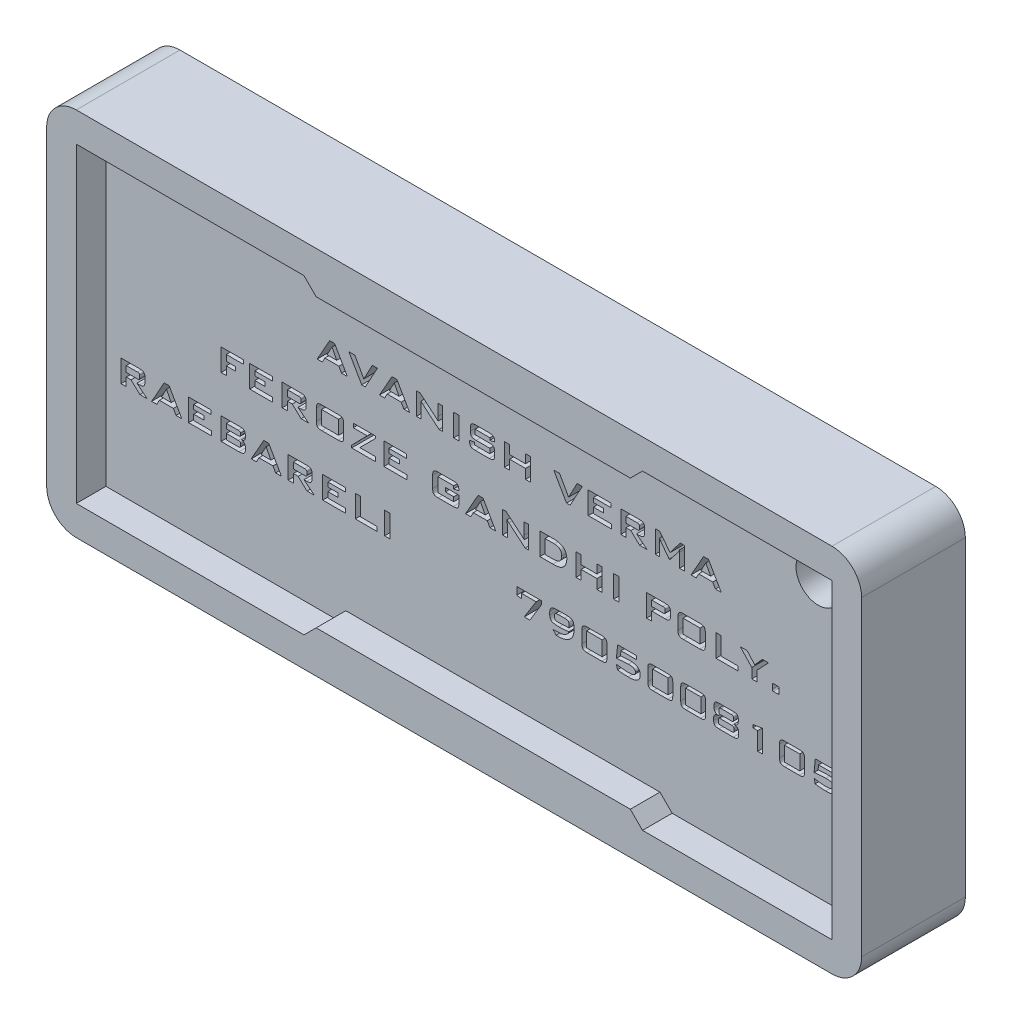
from build123d import *

# Parameters (mm, degrees)
BOSS_EXTRUDE1_DEPTH = 7
CUT_EXTRUDE1_DEPTH  = 2
CUT_EXTRUDE2_DEPTH  = 2
SKETCH4_W           = 0.348214285
SKETCH4_H           = 1.5
SKETCH4_W_2         = 1.151785715
SKETCH4_H_2         = 0.9375
SKETCH4_W_3         = 1.151785714
SKETCH4_W_4         = 0.348214286
SKETCH4_W_5         = 1.044642857
SKETCH4_H_3         = 0.991071429
SKETCH4_W_6         = 1.044642858
CUT_EXTRUDE10_DEPTH = 3
SKETCH5_R           = 1.5
CUT_EXTRUDE11_DEPTH = 3


with BuildPart() as part:
    # Sketch1 → Boss-Extrude1 (new body)
    with BuildSketch(Plane.XY):
        with BuildLine():
            Line((-25.5, -12.5), (25.5, -12.5))
            ThreePointArc((25.5, -12.5), (26.914213562, -11.914213562), (27.5, -10.5))
            Line((27.5, -10.5), (27.5, 10.5))
            ThreePointArc((27.5, 10.5), (26.914213562, 11.914213562), (25.5, 12.5))
            Line((25.5, 12.5), (-25.5, 12.5))
            ThreePointArc((-25.5, 12.5), (-26.914213562, 11.914213562), (-27.5, 10.5))
            Line((-27.5, 10.5), (-27.5, -10.5))
            ThreePointArc((-27.5, -10.5), (-26.914213562, -11.914213562), (-25.5, -12.5))
        make_face()
    extrude(amount=BOSS_EXTRUDE1_DEPTH)

    # Sketch2 → Cut-Extrude1 (cut)
    with BuildSketch(Plane(origin=(0, 0, 0), x_dir=(-1, 0, 0), z_dir=(0, 0, -1))):
        Polygon((9.271977879, 9.676470588), (10.095507291, 10.5), (25.5, 10.5), (25.5, -10.5), (10.095507291, -10.5), (9.271977879, -9.676470588), (-10.728443028, -9.676470588), (-11.55197244, -10.5), (-25.5, -10.5), (-25.5, 10.5), (-11.55197244, 10.5), (-10.728443028, 9.676470588), align=None)
    extrude(amount=-CUT_EXTRUDE1_DEPTH, mode=Mode.SUBTRACT)

    # Sketch3 → Cut-Extrude2 (cut)
    with BuildSketch(Plane.XY.offset(7)):
        Polygon((11.889346563, -9.676470588), (12.712875975, -10.5), (25.5, -10.5), (25.5, 10.5), (12.712875975, 10.5), (11.889346563, 9.676470588), (-9.312333999, 9.676470588), (-10.13586341, 10.5), (-25.5, 10.5), (-25.5, -10.5), (-10.13586341, -10.5), (-9.312333999, -9.676470588), align=None)
    extrude(amount=-CUT_EXTRUDE2_DEPTH, mode=Mode.SUBTRACT)

    # Sketch4 → Cut-Extrude10 (cut)
    # profile 1 of 48: a face of its own
    with BuildSketch(Plane.XY.offset(5)):
        Polygon((-11.244797852, 4.064684599), (-10.399792271, 5.564684599), (-10.06538937, 5.564684599), (-9.209083566, 4.064684599), (-9.59915053, 4.064684599), (-9.778279995, 4.38611317), (-10.724987584, 4.38611317), (-10.8986762, 4.064684599), align=None)
        Polygon((-10.576410575, 4.653970313), (-9.922671736, 4.653970313), (-10.244518834, 5.270878795), align=None, mode=Mode.SUBTRACT)
    # profile 2 of 48: a face of its own
    with BuildSketch(Plane.XY.offset(5)):
        Polygon((-8.236845843, 4.064684599), (-9.101940709, 5.564684599), (-8.703921736, 5.564684599), (-8.09789495, 4.480281697), (-7.520327986, 5.564684599), (-7.17336928, 5.564684599), (-7.996192941, 4.064684599), align=None)
    # profile 3 of 48: a face of its own
    with BuildSketch(Plane.XY.offset(5)):
        Polygon((-7.039440709, 4.064684599), (-6.194435129, 5.564684599), (-5.860032227, 5.564684599), (-5.003726423, 4.064684599), (-5.393793387, 4.064684599), (-5.572922852, 4.38611317), (-6.519630441, 4.38611317), (-6.693319057, 4.064684599), align=None)
        Polygon((-6.371053432, 4.653970313), (-5.717314593, 4.653970313), (-6.039161691, 5.270878795), align=None, mode=Mode.SUBTRACT)
    # profile 4 of 48: a face of its own
    with BuildSketch(Plane.XY.offset(5)):
        with BuildLine():
            Line((-4.54836928, 4.064684599), (-4.54836928, 5.564684599))
            Line((-4.54836928, 5.564684599), (-4.310227539, 5.564684599))
            Line((-4.310227539, 5.564684599), (-3.256377093, 4.680756028))
            add(Edge.make_bspline(
                [(-3.256377093, 4.680756028), (-3.239493026, 4.666687589), (-3.207284226, 4.639850009), (-3.163075862, 4.598594729), (-3.122618381, 4.55911157), (-3.098948249, 4.531250379), (-3.087292271, 4.517530581)],
                knots=[0, 0, 0, 0, 1.120249253, 2.137037449, 3.082613911, 4, 4, 4, 4], degree=3))
            add(Edge.make_bspline(
                [(-3.087292271, 4.517530581), (-3.08878945, 4.537055149), (-3.091547543, 4.573023175), (-3.093899451, 4.622335264), (-3.09737158, 4.662311933), (-3.099239744, 4.701399292), (-3.101179757, 4.738634977), (-3.101713872, 4.765575619), (-3.101940709, 4.777017188)],
                knots=[0, 0, 0, 0, 1.355957739, 2.497936089, 3.418200079, 4.134142845, 5.207578898, 6, 6, 6, 6], degree=3))
            Line((-3.101940709, 4.777017188), (-3.101940709, 5.564684599))
            Line((-3.101940709, 5.564684599), (-2.780512137, 5.564684599))
            Line((-2.780512137, 5.564684599), (-2.780512137, 4.064684599))
            Line((-2.780512137, 4.064684599), (-3.018235352, 4.064684599))
            Line((-3.018235352, 4.064684599), (-4.117286691, 4.991302903))
            add(Edge.make_bspline(
                [(-4.117286691, 4.991302903), (-4.129560346, 5.002605738), (-4.152651968, 5.023870863), (-4.185732536, 5.05425135), (-4.214826047, 5.083809674), (-4.232731276, 5.103681808), (-4.241589146, 5.113512724)],
                knots=[0, 0, 0, 0, 1.147977392, 2.159801589, 3.089637987, 4, 4, 4, 4], degree=3))
            add(Edge.make_bspline(
                [(-4.241589146, 5.113512724), (-4.239156353, 5.091068132), (-4.234418073, 5.047353473), (-4.230894613, 4.984341834), (-4.227393819, 4.927305182), (-4.227084435, 4.891558665), (-4.226940709, 4.874952456)],
                knots=[0, 0, 0, 0, 1.132776588, 2.206275, 3.166716816, 4, 4, 4, 4], degree=3))
            Line((-4.226940709, 4.874952456), (-4.226940709, 4.064684599))
            Line((-4.226940709, 4.064684599), (-4.54836928, 4.064684599))
        make_face()
    # profile 5 of 48: a face of its own
    with BuildSketch(Plane.XY.offset(5)):
        with Locations((-1.856404995, 4.814684599)):
            Rectangle(SKETCH4_W, SKETCH4_H)
    # profile 6 of 48: a face of its own
    with BuildSketch(Plane.XY.offset(5)):
        with BuildLine():
            Line((0.406987863, 5.296827456), (-0.584083566, 5.296827456))
            Line((-0.584083566, 5.296827456), (-0.584083566, 4.975398885))
            Line((-0.584083566, 4.975398885), (0.359694336, 4.975398885))
            add(Edge.make_bspline(
                [(0.359694336, 4.975398885), (0.376998164, 4.975135921), (0.410244809, 4.974630676), (0.457917623, 4.971430798), (0.50114983, 4.965696406), (0.539982079, 4.957455264), (0.574395181, 4.946516187), (0.604853925, 4.933871738), (0.630659321, 4.918171286), (0.652832741, 4.900281027), (0.671229828, 4.878638995), (0.686665816, 4.853276002), (0.699551277, 4.823933996), (0.710626033, 4.790804779), (0.717979751, 4.753195855), (0.724622254, 4.711933566), (0.727599247, 4.666428531), (0.728136332, 4.634859483), (0.728416434, 4.618395536)],
                knots=[0, 0, 0, 0, 1.367772418, 2.627964306, 3.774209366, 4.812406833, 5.761002095, 6.62542454, 7.412151408, 8.140697806, 8.867907727, 9.645227275, 10.47936741, 11.396482795, 12.400018212, 13.504170411, 14.698370419, 16, 16, 16, 16], degree=3))
            Line((0.728416434, 4.618395536), (0.728416434, 4.425036161))
            add(Edge.make_bspline(
                [(0.728416434, 4.425036161), (0.728136129, 4.408432753), (0.727598464, 4.376585117), (0.724621381, 4.330662828), (0.717974313, 4.288983949), (0.710630525, 4.250955435), (0.69952293, 4.217428909), (0.686790942, 4.187721852), (0.67110213, 4.162239931), (0.652852266, 4.140253715), (0.630795343, 4.121875844), (0.604827529, 4.106262729), (0.574477208, 4.093456936), (0.539896175, 4.083163675), (0.501127344, 4.074886839), (0.457955803, 4.068502051), (0.410239451, 4.065496196), (0.37699633, 4.064962415), (0.359694336, 4.064684599)],
                knots=[0, 0, 0, 0, 1.306286623, 2.505638534, 3.615286478, 4.624689038, 5.547786308, 6.387902616, 7.161452015, 7.893489904, 8.625527793, 9.408438884, 10.268668713, 11.209404527, 12.242566536, 13.384781828, 14.638861542, 16, 16, 16, 16], degree=3))
            Line((0.359694336, 4.064684599), (-0.575294504, 4.064684599))
            add(Edge.make_bspline(
                [(-0.575294504, 4.064684599), (-0.593294508, 4.064957383), (-0.627792969, 4.065480195), (-0.677448504, 4.06854769), (-0.722446114, 4.074844589), (-0.76299519, 4.083217668), (-0.799047191, 4.093282193), (-0.830511994, 4.106398206), (-0.857565525, 4.121759122), (-0.880568036, 4.140093926), (-0.899185702, 4.162350011), (-0.915871852, 4.187545269), (-0.928916604, 4.217426919), (-0.940450015, 4.250926319), (-0.948373518, 4.288930334), (-0.954698093, 4.330690804), (-0.958433107, 4.376560133), (-0.958860714, 4.408427908), (-0.959083566, 4.425036161)],
                knots=[0, 0, 0, 0, 1.387087703, 2.658465477, 3.830578432, 4.884708085, 5.847452617, 6.709911813, 7.504591087, 8.238253964, 8.962325029, 9.731586871, 10.558965555, 11.466600294, 12.457674711, 13.544672001, 14.720377912, 16, 16, 16, 16], degree=3))
            Line((-0.959083566, 4.425036161), (-0.959083566, 4.462285045))
            Line((-0.959083566, 4.462285045), (-0.637654995, 4.520041742))
            Line((-0.637654995, 4.520041742), (-0.637654995, 4.359327456))
            Line((-0.637654995, 4.359327456), (0.406987863, 4.359327456))
            Line((0.406987863, 4.359327456), (0.406987863, 4.680756028))
            Line((0.406987863, 4.680756028), (-0.516700754, 4.680756028))
            add(Edge.make_bspline(
                [(-0.516700754, 4.680756028), (-0.534979582, 4.681030718), (-0.570035145, 4.681557526), (-0.620389005, 4.684596981), (-0.665943811, 4.69091571), (-0.706902071, 4.699308662), (-0.743569509, 4.709352388), (-0.775410634, 4.722750854), (-0.80279985, 4.738353835), (-0.826106215, 4.756582518), (-0.84536045, 4.778753222), (-0.861715794, 4.804419798), (-0.875079991, 4.834416034), (-0.886243784, 4.868208479), (-0.894978735, 4.906182311), (-0.901072052, 4.948031173), (-0.904888851, 4.99402247), (-0.905298034, 5.026032509), (-0.905512137, 5.042781697)],
                knots=[0, 0, 0, 0, 1.395823795, 2.67694334, 3.848992384, 4.904005399, 5.868263797, 6.746679127, 7.534160941, 8.269481829, 8.993998302, 9.765246138, 10.585131202, 11.494644837, 12.479108773, 13.556261061, 14.721318532, 16, 16, 16, 16], degree=3))
            Line((-0.905512137, 5.042781697), (-0.905512137, 5.209773885))
            add(Edge.make_bspline(
                [(-0.905512137, 5.209773885), (-0.905289336, 5.226104046), (-0.904860225, 5.257555483), (-0.901106385, 5.302717881), (-0.894975869, 5.343866059), (-0.886272321, 5.381022866), (-0.874973382, 5.414057493), (-0.861851794, 5.443498156), (-0.845211388, 5.46842225), (-0.826116719, 5.490170625), (-0.802647822, 5.507853906), (-0.77552579, 5.523642167), (-0.743452601, 5.536375449), (-0.706918291, 5.546566362), (-0.665973266, 5.555058566), (-0.620350418, 5.560682771), (-0.570040935, 5.563929505), (-0.534981567, 5.564425812), (-0.516700754, 5.564684599)],
                knots=[0, 0, 0, 0, 1.258701001, 2.424223086, 3.490447603, 4.463426315, 5.361289957, 6.179275595, 6.939892267, 7.66333355, 8.399060938, 9.194101122, 10.07682987, 11.050343366, 12.115482555, 13.297362954, 14.590778877, 16, 16, 16, 16], degree=3))
            Line((-0.516700754, 5.564684599), (0.342534738, 5.564684599))
            add(Edge.make_bspline(
                [(0.342534738, 5.564684599), (0.360118659, 5.56443224), (0.393924807, 5.563947064), (0.442399584, 5.56060292), (0.486741781, 5.555314335), (0.526830157, 5.547595105), (0.562661579, 5.537089577), (0.594254225, 5.524604694), (0.621920895, 5.510085721), (0.645314875, 5.492537718), (0.665666741, 5.472497986), (0.682457041, 5.44854826), (0.696488882, 5.42127677), (0.708462245, 5.390604328), (0.717300069, 5.356433603), (0.724154985, 5.318827659), (0.727731728, 5.277644927), (0.728181896, 5.24898191), (0.728416434, 5.234048438)],
                knots=[0, 0, 0, 0, 1.41568109, 2.721732184, 3.91013719, 5.009362109, 6.00455359, 6.911876923, 7.741097504, 8.511642107, 9.25823642, 10.03123317, 10.855187836, 11.722921065, 12.67654954, 13.692257417, 14.797662949, 16, 16, 16, 16], degree=3))
            Line((0.728416434, 5.234048438), (0.728416434, 5.204333036))
            Line((0.728416434, 5.204333036), (0.406987863, 5.13611317))
            Line((0.406987863, 5.13611317), (0.406987863, 5.296827456))
        make_face()
    # profile 7 of 48: a face of its own
    with BuildSketch(Plane.XY.offset(5)):
        Polygon((1.398059291, 4.064684599), (1.398059291, 5.564684599), (1.746273577, 5.564684599), (1.746273577, 4.975398885), (2.817702148, 4.975398885), (2.817702148, 5.564684599), (3.165916434, 5.564684599), (3.165916434, 4.064684599), (2.817702148, 4.064684599), (2.817702148, 4.707541742), (1.746273577, 4.707541742), (1.746273577, 4.064684599), align=None)
    # profile 8 of 48: a face of its own
    with BuildSketch(Plane.XY.offset(5)):
        Polygon((5.584582729, 4.064684599), (4.719487863, 5.564684599), (5.117506836, 5.564684599), (5.723533621, 4.480281697), (6.301100586, 5.564684599), (6.648059291, 5.564684599), (5.82523563, 4.064684599), align=None)
    # profile 9 of 48: a face of its own
    with BuildSketch(Plane.XY.offset(5)):
        Polygon((7.049845005, 4.064684599), (7.049845005, 5.564684599), (8.57663072, 5.564684599), (8.57663072, 5.296827456), (7.398059291, 5.296827456), (7.398059291, 5.002184599), (8.094487863, 5.002184599), (8.094487863, 4.734327456), (7.398059291, 4.734327456), (7.398059291, 4.359327456), (8.603416434, 4.359327456), (8.603416434, 4.064684599), align=None)
    # profile 10 of 48: a face of its own
    with BuildSketch(Plane.XY.offset(5)):
        with BuildLine():
            Line((9.246273577, 4.064684599), (9.246273577, 5.564684599))
            Line((9.246273577, 5.564684599), (10.502272461, 5.564684599))
            add(Edge.make_bspline(
                [(10.502272461, 5.564684599), (10.517206215, 5.56442905), (10.545996776, 5.56393638), (10.587510388, 5.560597544), (10.625807884, 5.555163814), (10.661044775, 5.547914976), (10.693065765, 5.537727134), (10.722003037, 5.525710672), (10.747961909, 5.511583809), (10.770262731, 5.494404067), (10.790446008, 5.475605624), (10.807105879, 5.453448865), (10.821559181, 5.428928778), (10.833154923, 5.401584336), (10.842323469, 5.371703113), (10.849101698, 5.339222077), (10.852730502, 5.30388658), (10.853182156, 5.279396698), (10.853416434, 5.266693528)],
                knots=[0, 0, 0, 0, 1.346269442, 2.595452612, 3.75158065, 4.832033353, 5.834414348, 6.775760023, 7.65408242, 8.489200005, 9.307576234, 10.132689768, 10.978254376, 11.868383673, 12.803237522, 13.792353987, 14.854869862, 16, 16, 16, 16], degree=3))
            Line((10.853416434, 5.266693528), (10.853416434, 4.927686831))
            add(Edge.make_bspline(
                [(10.853416434, 4.927686831), (10.853185556, 4.914983021), (10.852740455, 4.890491905), (10.849052098, 4.855028838), (10.842382933, 4.822387398), (10.833165707, 4.792369247), (10.821455016, 4.764954374), (10.807126549, 4.740095715), (10.790436433, 4.717565438), (10.770416847, 4.698267343), (10.747827355, 4.681208514), (10.722139513, 4.666482945), (10.693050962, 4.654565796), (10.660993075, 4.644486791), (10.62587035, 4.636555506), (10.587500632, 4.631317563), (10.545999522, 4.627919897), (10.517207153, 4.627435735), (10.502272461, 4.627184599)],
                knots=[0, 0, 0, 0, 1.141503055, 2.20065352, 3.198915295, 4.13080809, 5.018117994, 5.871843704, 6.70431614, 7.528820333, 8.361292769, 9.243005007, 10.181369065, 11.180575121, 12.260302098, 13.412768219, 14.657994728, 16, 16, 16, 16], degree=3))
            Line((10.502272461, 4.627184599), (10.313098354, 4.627184599))
            Line((10.313098354, 4.627184599), (11.010363979, 4.064684599))
            Line((11.010363979, 4.064684599), (10.516502371, 4.064684599))
            Line((10.516502371, 4.064684599), (9.920520229, 4.627184599))
            Line((9.920520229, 4.627184599), (9.594487863, 4.627184599))
            Line((9.594487863, 4.627184599), (9.594487863, 4.064684599))
            Line((9.594487863, 4.064684599), (9.246273577, 4.064684599))
        make_face()
        with BuildLine():
            Line((10.352858398, 5.296827456), (9.594487863, 5.296827456))
            Line((9.594487863, 5.296827456), (9.594487863, 4.895041742))
            Line((9.594487863, 4.895041742), (10.352858398, 4.895041742))
            add(Edge.make_bspline(
                [(10.352858398, 4.895041742), (10.36640054, 4.895354), (10.391206971, 4.895925993), (10.425057482, 4.900099205), (10.451995735, 4.907870038), (10.473252502, 4.918779407), (10.488467083, 4.935098931), (10.498429113, 4.955950004), (10.504150519, 4.981376486), (10.504833408, 4.999780462), (10.505202148, 5.009718081)],
                knots=[0, 0, 0, 0, 1.458933349, 2.672467135, 3.661336039, 4.468510999, 5.212651608, 6.019126806, 6.930385295, 8, 8, 8, 8], degree=3))
            Line((10.505202148, 5.009718081), (10.505202148, 5.183406697))
            add(Edge.make_bspline(
                [(10.505202148, 5.183406697), (10.50479779, 5.193055865), (10.504039006, 5.211162694), (10.498641895, 5.236165392), (10.488216832, 5.25651957), (10.473170504, 5.2726277), (10.452131579, 5.284114859), (10.425032394, 5.291721544), (10.391215379, 5.295959442), (10.366403509, 5.296520932), (10.352858398, 5.296827456)],
                knots=[0, 0, 0, 0, 1.046090615, 1.963007084, 2.747556831, 3.496317789, 4.315930819, 5.310939585, 6.532008172, 8, 8, 8, 8], degree=3))
        make_face(mode=Mode.SUBTRACT)
    # profile 11 of 48: a face of its own
    with BuildSketch(Plane.XY.offset(5)):
        with BuildLine():
            Line((11.57663072, 4.064684599), (11.57663072, 5.564684599))
            Line((11.57663072, 5.564684599), (11.871273577, 5.564684599))
            Line((11.871273577, 5.564684599), (12.570213309, 4.662759376))
            Line((12.570213309, 4.662759376), (13.25492313, 5.564684599))
            Line((13.25492313, 5.564684599), (13.531987863, 5.564684599))
            Line((13.531987863, 5.564684599), (13.531987863, 4.064684599))
            Line((13.531987863, 4.064684599), (13.210559291, 4.064684599))
            Line((13.210559291, 4.064684599), (13.210559291, 4.994651117))
            add(Edge.make_bspline(
                [(13.210559291, 4.994651117), (13.210756293, 5.004838625), (13.211193929, 5.027470042), (13.213909675, 5.064594955), (13.218214037, 5.10752945), (13.221427178, 5.138067609), (13.223115095, 5.154109822)],
                knots=[0, 0, 0, 0, 0.764017789, 1.697255667, 2.790329359, 4, 4, 4, 4], degree=3))
            add(Edge.make_bspline(
                [(13.223115095, 5.154109822), (13.214478716, 5.136312754), (13.198782786, 5.103968001), (13.175319, 5.060940128), (13.155647926, 5.025956918), (13.142179202, 5.006156086), (13.136061523, 4.997162278)],
                knots=[0, 0, 0, 0, 1.321116622, 2.401024161, 3.27372327, 4, 4, 4, 4], degree=3))
            Line((13.136061523, 4.997162278), (12.578583845, 4.252184599))
            Line((12.578583845, 4.252184599), (12.509945452, 4.252184599))
            Line((12.509945452, 4.252184599), (11.951212193, 5.000091965))
            add(Edge.make_bspline(
                [(11.951212193, 5.000091965), (11.941623076, 5.013691676), (11.923290922, 5.039691151), (11.898487651, 5.078306356), (11.878857256, 5.115788501), (11.867806876, 5.140522638), (11.862484514, 5.152435715)],
                knots=[0, 0, 0, 0, 1.130076345, 2.160442332, 3.113985983, 4, 4, 4, 4], degree=3))
            add(Edge.make_bspline(
                [(11.862484514, 5.152435715), (11.864000918, 5.137657288), (11.866887266, 5.10952779), (11.869144256, 5.06888342), (11.871143946, 5.031082781), (11.871230877, 5.006651566), (11.871273577, 4.994651117)],
                knots=[0, 0, 0, 0, 1.127408403, 2.145927464, 3.089291986, 4, 4, 4, 4], degree=3))
            Line((11.871273577, 4.994651117), (11.871273577, 4.064684599))
            Line((11.871273577, 4.064684599), (11.57663072, 4.064684599))
        make_face()
    # profile 12 of 48: a face of its own
    with BuildSketch(Plane.XY.offset(5)):
        Polygon((13.987345005, 4.064684599), (14.832350586, 5.564684599), (15.166753488, 5.564684599), (16.023059291, 4.064684599), (15.632992327, 4.064684599), (15.453862863, 4.38611317), (14.507155273, 4.38611317), (14.333466657, 4.064684599), align=None)
        Polygon((14.655732282, 4.653970313), (15.309471121, 4.653970313), (14.987624023, 5.270878795), align=None, mode=Mode.SUBTRACT)
    # profile 13 of 48: a face of its own
    with BuildSketch(Plane.XY.offset(5)):
        Polygon((-17.726940709, 0.037898885), (-17.726940709, 1.537898885), (-16.226940709, 1.537898885), (-16.226940709, 1.270041742), (-17.378726423, 1.270041742), (-17.378726423, 0.868256028), (-16.762654995, 0.868256028), (-16.762654995, 0.600398885), (-17.378726423, 0.600398885), (-17.378726423, 0.037898885), align=None)
    # profile 14 of 48: a face of its own
    with BuildSketch(Plane.XY.offset(5)):
        Polygon((-15.79836928, 0.037898885), (-15.79836928, 1.537898885), (-14.271583566, 1.537898885), (-14.271583566, 1.270041742), (-15.450154995, 1.270041742), (-15.450154995, 0.975398885), (-14.753726423, 0.975398885), (-14.753726423, 0.707541742), (-15.450154995, 0.707541742), (-15.450154995, 0.332541742), (-14.244797852, 0.332541742), (-14.244797852, 0.037898885), align=None)
    # profile 15 of 48: a face of its own
    with BuildSketch(Plane.XY.offset(5)):
        with BuildLine():
            Line((-13.601940709, 0.037898885), (-13.601940709, 1.537898885))
            Line((-13.601940709, 1.537898885), (-12.345941825, 1.537898885))
            add(Edge.make_bspline(
                [(-12.345941825, 1.537898885), (-12.331008071, 1.537643335), (-12.30221751, 1.537150665), (-12.260703898, 1.53381183), (-12.222406402, 1.5283781), (-12.187169511, 1.521129261), (-12.155148521, 1.51094142), (-12.126211249, 1.498924958), (-12.100252377, 1.484798094), (-12.077951554, 1.467618353), (-12.057768278, 1.44881991), (-12.041108407, 1.426663151), (-12.026655105, 1.402143064), (-12.015059362, 1.374798622), (-12.005890817, 1.344917398), (-11.999112588, 1.312436362), (-11.995483783, 1.277100866), (-11.99503213, 1.252610983), (-11.994797852, 1.239907813)],
                knots=[0, 0, 0, 0, 1.346269442, 2.595452612, 3.75158065, 4.832033353, 5.834414348, 6.775760023, 7.65408242, 8.489200005, 9.307576234, 10.132689768, 10.978254376, 11.868383673, 12.803237522, 13.792353987, 14.854869862, 16, 16, 16, 16], degree=3))
            Line((-11.994797852, 1.239907813), (-11.994797852, 0.900901117))
            add(Edge.make_bspline(
                [(-11.994797852, 0.900901117), (-11.99502873, 0.888197307), (-11.99547383, 0.863706191), (-11.999162188, 0.828243123), (-12.005831353, 0.795601684), (-12.015048579, 0.765583533), (-12.026759269, 0.73816866), (-12.041087737, 0.713310001), (-12.057777852, 0.690779723), (-12.077797439, 0.671481629), (-12.100386931, 0.6544228), (-12.126074773, 0.639697231), (-12.155163323, 0.627780082), (-12.18722121, 0.617701077), (-12.222343935, 0.609769791), (-12.260713654, 0.604531849), (-12.302214764, 0.601134182), (-12.331007133, 0.600650021), (-12.345941825, 0.600398885)],
                knots=[0, 0, 0, 0, 1.141503055, 2.20065352, 3.198915295, 4.13080809, 5.018117994, 5.871843704, 6.70431614, 7.528820333, 8.361292769, 9.243005007, 10.181369065, 11.180575121, 12.260302098, 13.412768219, 14.657994728, 16, 16, 16, 16], degree=3))
            Line((-12.345941825, 0.600398885), (-12.535115932, 0.600398885))
            Line((-12.535115932, 0.600398885), (-11.837850307, 0.037898885))
            Line((-11.837850307, 0.037898885), (-12.331711914, 0.037898885))
            Line((-12.331711914, 0.037898885), (-12.927694057, 0.600398885))
            Line((-12.927694057, 0.600398885), (-13.253726423, 0.600398885))
            Line((-13.253726423, 0.600398885), (-13.253726423, 0.037898885))
            Line((-13.253726423, 0.037898885), (-13.601940709, 0.037898885))
        make_face()
        with BuildLine():
            Line((-12.495355887, 1.270041742), (-13.253726423, 1.270041742))
            Line((-13.253726423, 1.270041742), (-13.253726423, 0.868256028))
            Line((-13.253726423, 0.868256028), (-12.495355887, 0.868256028))
            add(Edge.make_bspline(
                [(-12.495355887, 0.868256028), (-12.481813746, 0.868568286), (-12.457007315, 0.869140279), (-12.423156804, 0.873313491), (-12.396218551, 0.881084324), (-12.374961783, 0.891993693), (-12.359747203, 0.908313217), (-12.349785173, 0.92916429), (-12.344063767, 0.954590772), (-12.343380878, 0.972994748), (-12.343012137, 0.982932367)],
                knots=[0, 0, 0, 0, 1.458933349, 2.672467135, 3.661336039, 4.468510999, 5.212651608, 6.019126806, 6.930385295, 8, 8, 8, 8], degree=3))
            Line((-12.343012137, 0.982932367), (-12.343012137, 1.156620983))
            add(Edge.make_bspline(
                [(-12.343012137, 1.156620983), (-12.343416495, 1.16627015), (-12.34417528, 1.18437698), (-12.349572391, 1.209379677), (-12.359997454, 1.229733855), (-12.375043781, 1.245841985), (-12.396082707, 1.257329145), (-12.423181892, 1.26493583), (-12.456998907, 1.269173727), (-12.481810777, 1.269735217), (-12.495355887, 1.270041742)],
                knots=[0, 0, 0, 0, 1.046090615, 1.963007084, 2.747556831, 3.496317789, 4.315930819, 5.310939585, 6.532008172, 8, 8, 8, 8], degree=3))
        make_face(mode=Mode.SUBTRACT)
    # profile 16 of 48: a face of its own
    with BuildSketch(Plane.XY.offset(5)):
        with BuildLine():
            add(Edge.make_bspline(
                [(-11.29836928, 1.184662278), (-11.298093144, 1.200987962), (-11.297563851, 1.232280725), (-11.294546859, 1.27721509), (-11.288108913, 1.318009021), (-11.279820544, 1.354950259), (-11.269730161, 1.388091231), (-11.256591069, 1.417043883), (-11.241074558, 1.44205075), (-11.222770166, 1.463581647), (-11.200669754, 1.481707285), (-11.174302744, 1.496533078), (-11.1439298, 1.509688754), (-11.108987094, 1.519771272), (-11.069863921, 1.528253371), (-11.026326426, 1.533886326), (-10.978386594, 1.537150714), (-10.944998749, 1.537642132), (-10.927554548, 1.537898885)],
                knots=[0, 0, 0, 0, 1.293123629, 2.478634986, 3.563098107, 4.560178897, 5.475689474, 6.301390939, 7.070844362, 7.799472889, 8.529440499, 9.321564234, 10.187672952, 11.145411708, 12.196433596, 13.355863688, 14.618513897, 16, 16, 16, 16], degree=3))
            Line((-10.927554548, 1.537898885), (-9.822643834, 1.537898885))
            add(Edge.make_bspline(
                [(-9.822643834, 1.537898885), (-9.805200183, 1.537636386), (-9.771674219, 1.537131876), (-9.72358861, 1.533922952), (-9.67978885, 1.52819554), (-9.640499928, 1.519834793), (-9.605433566, 1.509682407), (-9.575055705, 1.496536038), (-9.548700142, 1.481701725), (-9.526562113, 1.463599624), (-9.508349472, 1.441924799), (-9.492238251, 1.417194979), (-9.479354477, 1.387989387), (-9.468549936, 1.355048217), (-9.460464838, 1.317992004), (-9.453962376, 1.277220264), (-9.450964737, 1.232279242), (-9.45043261, 1.200987453), (-9.450154995, 1.184662278)],
                knots=[0, 0, 0, 0, 1.378802044, 2.649999501, 3.807176962, 4.866940143, 5.82281813, 6.687244104, 7.477828839, 8.206378212, 8.933591102, 9.707464615, 10.531561843, 11.448680973, 12.443824557, 13.526180699, 14.709388752, 16, 16, 16, 16], degree=3))
            Line((-9.450154995, 1.184662278), (-9.450154995, 0.404109822))
            add(Edge.make_bspline(
                [(-9.450154995, 0.404109822), (-9.450426925, 0.387086578), (-9.450946833, 0.35453949), (-9.454014443, 0.307661015), (-9.460384, 0.265195578), (-9.468561098, 0.226626001), (-9.479381779, 0.192448269), (-9.492147037, 0.162087841), (-9.508231076, 0.136465604), (-9.526554486, 0.114317426), (-9.54866462, 0.095772852), (-9.57502881, 0.080507599), (-9.605410027, 0.066964109), (-9.640426501, 0.056275411), (-9.679796915, 0.048026753), (-9.72360555, 0.04241469), (-9.771653248, 0.038512494), (-9.805196526, 0.038108842), (-9.822643834, 0.037898885)],
                knots=[0, 0, 0, 0, 1.321305897, 2.526231642, 3.642473957, 4.651255567, 5.582638206, 6.421441783, 7.19956333, 7.921821202, 8.644079073, 9.425807925, 10.278884728, 11.220593779, 12.261122903, 13.397298297, 14.646222374, 16, 16, 16, 16], degree=3))
            Line((-9.822643834, 0.037898885), (-10.927554548, 0.037898885))
            add(Edge.make_bspline(
                [(-10.927554548, 0.037898885), (-10.945002486, 0.038102482), (-10.978407861, 0.038492285), (-11.026309194, 0.042452556), (-11.069855912, 0.047968781), (-11.109060113, 0.05634046), (-11.143953304, 0.06695785), (-11.174329673, 0.080510479), (-11.200705204, 0.095767503), (-11.222777935, 0.114334749), (-11.241194818, 0.136342654), (-11.256676505, 0.162237493), (-11.26970651, 0.192348509), (-11.279807748, 0.226721035), (-11.288191021, 0.265178729), (-11.29449452, 0.307666099), (-11.297581838, 0.354538031), (-11.29809886, 0.387086076), (-11.29836928, 0.404109822)],
                knots=[0, 0, 0, 0, 1.356343368, 2.596820197, 3.735148924, 4.767042452, 5.710536274, 6.565229867, 7.348440287, 8.072067016, 8.795693744, 9.569609139, 10.410002456, 11.339929157, 12.350622657, 13.468980527, 14.676189903, 16, 16, 16, 16], degree=3))
            Line((-11.29836928, 0.404109822), (-11.29836928, 1.184662278))
        make_face()
        with Locations((-10.374262138, 0.801291742)):
            Rectangle(SKETCH4_W_2, SKETCH4_H_2, mode=Mode.SUBTRACT)
    # profile 17 of 48: a face of its own
    with BuildSketch(Plane.XY.offset(5)):
        Polygon((-8.914440709, 0.037898885), (-8.914440709, 0.201124331), (-7.867286691, 1.270041742), (-8.807297852, 1.270041742), (-8.807297852, 1.537898885), (-7.307297852, 1.537898885), (-7.307297852, 1.390577456), (-8.3674262, 0.332541742), (-7.307297852, 0.332541742), (-7.307297852, 0.037898885), align=None)
    # profile 18 of 48: a face of its own
    with BuildSketch(Plane.XY.offset(5)):
        Polygon((-6.744797852, 0.037898885), (-6.744797852, 1.537898885), (-5.218012137, 1.537898885), (-5.218012137, 1.270041742), (-6.396583566, 1.270041742), (-6.396583566, 0.975398885), (-5.700154995, 0.975398885), (-5.700154995, 0.707541742), (-6.396583566, 0.707541742), (-6.396583566, 0.332541742), (-5.191226423, 0.332541742), (-5.191226423, 0.037898885), align=None)
    # profile 19 of 48: a face of its own
    with BuildSketch(Plane.XY.offset(5)):
        with BuildLine():
            Line((-2.030512137, 1.270041742), (-3.101940709, 1.270041742))
            Line((-3.101940709, 1.270041742), (-3.101940709, 0.332541742))
            Line((-3.101940709, 0.332541742), (-2.030512137, 0.332541742))
            Line((-2.030512137, 0.332541742), (-2.030512137, 0.627184599))
            Line((-2.030512137, 0.627184599), (-2.593012137, 0.627184599))
            Line((-2.593012137, 0.627184599), (-2.593012137, 0.895041742))
            Line((-2.593012137, 0.895041742), (-1.682297852, 0.895041742))
            Line((-1.682297852, 0.895041742), (-1.682297852, 0.39657634))
            add(Edge.make_bspline(
                [(-1.682297852, 0.39657634), (-1.682506506, 0.379964904), (-1.682908617, 0.347951942), (-1.686843526, 0.30214428), (-1.692304086, 0.260212804), (-1.701193392, 0.22276308), (-1.711833804, 0.18903942), (-1.725731553, 0.159778618), (-1.741554993, 0.1341965), (-1.76042719, 0.112598116), (-1.783064951, 0.094575304), (-1.809685068, 0.079068572), (-1.840973967, 0.066172814), (-1.87670247, 0.056019057), (-1.916806079, 0.047514256), (-1.961460328, 0.041922478), (-2.01065223, 0.038647177), (-2.044876063, 0.038155505), (-2.0627387, 0.037898885)],
                knots=[0, 0, 0, 0, 1.287740876, 2.481687819, 3.563317017, 4.56308199, 5.462791776, 6.299975377, 7.068275841, 7.7887847, 8.511887658, 9.302262014, 10.170193235, 11.128662927, 12.178892482, 13.346275316, 14.614926642, 16, 16, 16, 16], degree=3))
            Line((-2.0627387, 0.037898885), (-3.079758789, 0.037898885))
            add(Edge.make_bspline(
                [(-3.079758789, 0.037898885), (-3.097202782, 0.038156223), (-3.13059023, 0.038648764), (-3.178532771, 0.041905498), (-3.222061249, 0.047563931), (-3.261083005, 0.055935339), (-3.295806347, 0.066233208), (-3.326227783, 0.079162264), (-3.352340443, 0.094569077), (-3.374562739, 0.112613933), (-3.39296825, 0.134237964), (-3.408481758, 0.1597038), (-3.421317274, 0.189186181), (-3.431766489, 0.222757331), (-3.43985429, 0.260316986), (-3.446366836, 0.302069074), (-3.449329297, 0.347984415), (-3.449872851, 0.379972326), (-3.450154995, 0.39657634)],
                knots=[0, 0, 0, 0, 1.370936796, 2.623945153, 3.774521602, 4.817517675, 5.757449821, 6.616944758, 7.408582044, 8.132975475, 8.856040047, 9.628928604, 10.468327203, 11.376846756, 12.387708688, 13.485566836, 14.694829334, 16, 16, 16, 16], degree=3))
            Line((-3.450154995, 0.39657634), (-3.450154995, 1.172943528))
            add(Edge.make_bspline(
                [(-3.450154995, 1.172943528), (-3.449883453, 1.189827486), (-3.44936448, 1.22209631), (-3.446294779, 1.268555191), (-3.439916097, 1.310746741), (-3.431676871, 1.348962733), (-3.421403713, 1.383142278), (-3.40847188, 1.413146586), (-3.392973826, 1.439028123), (-3.374580592, 1.461071993), (-3.352371402, 1.479552225), (-3.32625748, 1.495387266), (-3.295827576, 1.508713802), (-3.26115762, 1.51954966), (-3.22205285, 1.52780896), (-3.17851566, 1.533351314), (-3.130611463, 1.537303733), (-3.097206508, 1.537694686), (-3.079758789, 1.537898885)],
                knots=[0, 0, 0, 0, 1.316875037, 2.516827271, 3.627751946, 4.641454711, 5.56374866, 6.406644186, 7.182863856, 7.908645129, 8.634426403, 9.425599436, 10.282837816, 11.218764033, 12.253729947, 13.395447964, 14.63961822, 16, 16, 16, 16], degree=3))
            Line((-3.079758789, 1.537898885), (-2.0627387, 1.537898885))
            add(Edge.make_bspline(
                [(-2.0627387, 1.537898885), (-2.045016443, 1.537637695), (-2.011073005, 1.53713744), (-1.96242478, 1.533934026), (-1.918227703, 1.528150498), (-1.87828802, 1.519934538), (-1.842729093, 1.509087081), (-1.8113317, 1.496362978), (-1.784707748, 1.480667493), (-1.761651765, 1.462837468), (-1.74271741, 1.44128373), (-1.72593581, 1.416744409), (-1.7129249, 1.387804956), (-1.701516517, 1.355513585), (-1.692828883, 1.319178883), (-1.686757551, 1.279139924), (-1.682924242, 1.235238394), (-1.682512709, 1.204760035), (-1.682297852, 1.188847545)],
                knots=[0, 0, 0, 0, 1.397762872, 2.67713531, 3.842667912, 4.91085992, 5.888884288, 6.771660048, 7.57555246, 8.319614666, 9.059761586, 9.828787419, 10.655693125, 11.553495066, 12.527550264, 13.596648575, 14.745230877, 16, 16, 16, 16], degree=3))
            Line((-1.682297852, 1.188847545), (-1.682297852, 1.150761608))
            Line((-1.682297852, 1.150761608), (-2.030512137, 1.082541742))
            Line((-2.030512137, 1.082541742), (-2.030512137, 1.270041742))
        make_face()
    # profile 20 of 48: a face of its own
    with BuildSketch(Plane.XY.offset(5)):
        Polygon((-1.226940709, 0.037898885), (-0.381935129, 1.537898885), (-0.047532227, 1.537898885), (0.808773577, 0.037898885), (0.418706613, 0.037898885), (0.239577148, 0.359327456), (-0.707130441, 0.359327456), (-0.880819057, 0.037898885), align=None)
        Polygon((-0.558553432, 0.627184599), (0.095185407, 0.627184599), (-0.226661691, 1.244093081), align=None, mode=Mode.SUBTRACT)
    # profile 21 of 48: a face of its own
    with BuildSketch(Plane.XY.offset(5)):
        with BuildLine():
            Line((1.26413072, 0.037898885), (1.26413072, 1.537898885))
            Line((1.26413072, 1.537898885), (1.502272461, 1.537898885))
            Line((1.502272461, 1.537898885), (2.556122907, 0.653970313))
            add(Edge.make_bspline(
                [(2.556122907, 0.653970313), (2.573006974, 0.639901875), (2.605215774, 0.613064295), (2.649424138, 0.571809015), (2.689881619, 0.532325856), (2.713551751, 0.504464664), (2.725207729, 0.490744867)],
                knots=[0, 0, 0, 0, 1.120249253, 2.137037449, 3.082613911, 4, 4, 4, 4], degree=3))
            add(Edge.make_bspline(
                [(2.725207729, 0.490744867), (2.72371055, 0.510269435), (2.720952457, 0.546237461), (2.718600549, 0.59554955), (2.71512842, 0.635526219), (2.713260256, 0.674613578), (2.711320243, 0.711849263), (2.710786128, 0.738789905), (2.710559291, 0.750231474)],
                knots=[0, 0, 0, 0, 1.355957739, 2.497936089, 3.418200079, 4.134142845, 5.207578898, 6, 6, 6, 6], degree=3))
            Line((2.710559291, 0.750231474), (2.710559291, 1.537898885))
            Line((2.710559291, 1.537898885), (3.031987863, 1.537898885))
            Line((3.031987863, 1.537898885), (3.031987863, 0.037898885))
            Line((3.031987863, 0.037898885), (2.794264648, 0.037898885))
            Line((2.794264648, 0.037898885), (1.695213309, 0.964517188))
            add(Edge.make_bspline(
                [(1.695213309, 0.964517188), (1.682939654, 0.975820024), (1.659848032, 0.997085149), (1.626767464, 1.027465636), (1.597673953, 1.057023959), (1.579768724, 1.076896094), (1.570910854, 1.08672701)],
                knots=[0, 0, 0, 0, 1.147977392, 2.159801589, 3.089637987, 4, 4, 4, 4], degree=3))
            add(Edge.make_bspline(
                [(1.570910854, 1.08672701), (1.573343647, 1.064282418), (1.578081927, 1.020567758), (1.581605387, 0.95755612), (1.585106181, 0.900519467), (1.585415565, 0.86477295), (1.585559291, 0.848166742)],
                knots=[0, 0, 0, 0, 1.132776588, 2.206275, 3.166716816, 4, 4, 4, 4], degree=3))
            Line((1.585559291, 0.848166742), (1.585559291, 0.037898885))
            Line((1.585559291, 0.037898885), (1.26413072, 0.037898885))
        make_face()
    # profile 22 of 48: a face of its own
    with BuildSketch(Plane.XY.offset(5)):
        with BuildLine():
            Line((3.781987863, 0.037898885), (3.781987863, 1.537898885))
            Line((3.781987863, 1.537898885), (4.752970005, 1.537898885))
            add(Edge.make_bspline(
                [(4.752970005, 1.537898885), (4.786197297, 1.537416116), (4.85069534, 1.536479005), (4.944527294, 1.526955016), (5.032425565, 1.512180568), (5.114607917, 1.491418847), (5.190641654, 1.46408235), (5.261043419, 1.43123944), (5.325100456, 1.391414133), (5.383439071, 1.346241556), (5.435738839, 1.295545567), (5.480592269, 1.239118673), (5.518753248, 1.177777662), (5.549551122, 1.111344232), (5.574189883, 1.040029844), (5.590910416, 0.963467411), (5.601759353, 0.881960212), (5.602854487, 0.825881966), (5.603416434, 0.797106474)],
                knots=[0, 0, 0, 0, 1.242861969, 2.412539815, 3.524699052, 4.575498151, 5.579366733, 6.543698167, 7.476577852, 8.395405235, 9.299766229, 10.194860487, 11.085682924, 11.996393759, 12.929054364, 13.902875057, 14.923899967, 16, 16, 16, 16], degree=3))
            add(Edge.make_bspline(
                [(5.603416434, 0.797106474), (5.602373785, 0.7628664), (5.600332059, 0.695817177), (5.584211607, 0.597779272), (5.556872515, 0.505211965), (5.519215965, 0.418474647), (5.472173715, 0.338708818), (5.415270261, 0.267623377), (5.349991927, 0.204786512), (5.299967392, 0.171131934), (5.274872907, 0.154249331)],
                knots=[0, 0, 0, 0, 1.088604448, 2.131715092, 3.14957863, 4.151102569, 5.131969807, 6.085469301, 7.039588017, 8, 8, 8, 8], degree=3))
            add(Edge.make_bspline(
                [(5.274872907, 0.154249331), (5.257763407, 0.144390473), (5.222655153, 0.124160348), (5.164551771, 0.10010316), (5.100799894, 0.080118004), (5.030375483, 0.064244363), (4.952216191, 0.052131826), (4.864565019, 0.044268164), (4.766995164, 0.038584208), (4.698431591, 0.038134245), (4.66256822, 0.037898885)],
                knots=[0, 0, 0, 0, 0.750496655, 1.539999875, 2.385899833, 3.289617478, 4.283366874, 5.392274889, 6.635983943, 8, 8, 8, 8], degree=3))
            Line((4.66256822, 0.037898885), (3.781987863, 0.037898885))
        make_face()
        with BuildLine():
            Line((4.130202148, 0.332541742), (4.586396345, 0.332541742))
            add(Edge.make_bspline(
                [(4.586396345, 0.332541742), (4.615705087, 0.332779759), (4.672145325, 0.333238112), (4.753389509, 0.339036335), (4.828089806, 0.346872445), (4.896019394, 0.359063814), (4.957581545, 0.374258307), (5.012324109, 0.393437676), (5.060817774, 0.415547764), (5.102964828, 0.441606613), (5.139038185, 0.472360875), (5.170419983, 0.50701164), (5.197026555, 0.546258147), (5.218320267, 0.590337054), (5.235111758, 0.638637424), (5.246595842, 0.69147743), (5.253810609, 0.748637254), (5.254727478, 0.788294426), (5.255202148, 0.808825224)],
                knots=[0, 0, 0, 0, 1.484235352, 2.858211929, 4.123964917, 5.286936566, 6.351261164, 7.332386366, 8.220772881, 9.046224222, 9.833402498, 10.613923553, 11.407703218, 12.226229102, 13.086632385, 13.991834928, 14.96035875, 16, 16, 16, 16], degree=3))
            add(Edge.make_bspline(
                [(5.255202148, 0.808825224), (5.25480095, 0.827257902), (5.254023764, 0.862964996), (5.248025141, 0.914749865), (5.238627684, 0.963161275), (5.224805116, 1.008226282), (5.206832072, 1.049785306), (5.184863171, 1.087799414), (5.159213973, 1.122534313), (5.129225857, 1.153545655), (5.095647256, 1.181390157), (5.058148711, 1.205185837), (5.017111403, 1.225584015), (4.972061156, 1.241624317), (4.92338533, 1.254703374), (4.870853357, 1.263722939), (4.814613619, 1.269252348), (4.775862986, 1.26977334), (4.755899693, 1.270041742)],
                knots=[0, 0, 0, 0, 1.137546326, 2.203612251, 3.213558663, 4.177827104, 5.107321516, 6.002430897, 6.8825431, 7.76568351, 8.658802282, 9.568946904, 10.500951153, 11.481690972, 12.515692713, 13.608687552, 14.768059607, 16, 16, 16, 16], degree=3))
            Line((4.755899693, 1.270041742), (4.130202148, 1.270041742))
            Line((4.130202148, 1.270041742), (4.130202148, 0.332541742))
        make_face(mode=Mode.SUBTRACT)
    # profile 23 of 48: a face of its own
    with BuildSketch(Plane.XY.offset(5)):
        Polygon((6.219487863, 0.037898885), (6.219487863, 1.537898885), (6.567702148, 1.537898885), (6.567702148, 0.94861317), (7.63913072, 0.94861317), (7.63913072, 1.537898885), (7.987345005, 1.537898885), (7.987345005, 0.037898885), (7.63913072, 0.037898885), (7.63913072, 0.680756028), (6.567702148, 0.680756028), (6.567702148, 0.037898885), align=None)
    # profile 24 of 48: a face of its own
    with BuildSketch(Plane.XY.offset(5)):
        with Locations((8.938237862, 0.787898885)):
            Rectangle(SKETCH4_W, SKETCH4_H)
    # profile 25 of 48: a face of its own
    with BuildSketch(Plane.XY.offset(5)):
        with BuildLine():
            Line((10.987345005, 0.037898885), (10.987345005, 1.537898885))
            Line((10.987345005, 1.537898885), (12.243343889, 1.537898885))
            add(Edge.make_bspline(
                [(12.243343889, 1.537898885), (12.258271086, 1.537574163), (12.28703847, 1.536948365), (12.328649428, 1.534531601), (12.366828677, 1.528194552), (12.402147063, 1.521225504), (12.434000219, 1.510763036), (12.463327887, 1.499569517), (12.488753938, 1.4846373), (12.511488668, 1.468114543), (12.531489412, 1.449200946), (12.548196218, 1.427096906), (12.562516588, 1.402648724), (12.574322477, 1.375540338), (12.583440212, 1.345620166), (12.590127753, 1.312985968), (12.593795907, 1.277659748), (12.594252356, 1.253308837), (12.594487863, 1.240744867)],
                knots=[0, 0, 0, 0, 1.347703027, 2.597265316, 3.756472026, 4.838075257, 5.841523645, 6.779065295, 7.664521021, 8.493004291, 9.312251974, 10.138244136, 10.984709149, 11.864237222, 12.800086557, 13.802586655, 14.866233958, 16, 16, 16, 16], degree=3))
            Line((12.594487863, 1.240744867), (12.594487863, 0.924338617))
            add(Edge.make_bspline(
                [(12.594487863, 0.924338617), (12.594256327, 0.911774421), (12.593810131, 0.887561796), (12.590134264, 0.852512149), (12.583397472, 0.820165833), (12.574225713, 0.790284925), (12.562630768, 0.762940404), (12.548177267, 0.738420337), (12.531517447, 0.716263573), (12.511334157, 0.697465131), (12.489033338, 0.680285389), (12.463074465, 0.666158526), (12.434137194, 0.654142064), (12.402116203, 0.643954222), (12.366879313, 0.636705384), (12.328581817, 0.631271654), (12.287068204, 0.627932818), (12.258277644, 0.627440148), (12.243343889, 0.627184599)],
                knots=[0, 0, 0, 0, 1.134337726, 2.185997142, 3.176666153, 4.112987375, 5.004513844, 5.851405674, 6.67781433, 7.497475106, 8.333903515, 9.213604551, 10.156427789, 11.16038215, 12.242530762, 13.400473492, 14.651617415, 16, 16, 16, 16], degree=3))
            Line((12.243343889, 0.627184599), (11.335559291, 0.627184599))
            Line((11.335559291, 0.627184599), (11.335559291, 0.037898885))
            Line((11.335559291, 0.037898885), (10.987345005, 0.037898885))
        make_face()
        with BuildLine():
            Line((12.093929827, 1.270041742), (11.335559291, 1.270041742))
            Line((11.335559291, 1.270041742), (11.335559291, 0.895041742))
            Line((11.335559291, 0.895041742), (12.093929827, 0.895041742))
            add(Edge.make_bspline(
                [(12.093929827, 0.895041742), (12.107479078, 0.895332089), (12.132298533, 0.895863946), (12.166029781, 0.900279235), (12.193157578, 0.907335129), (12.214162252, 0.918403339), (12.229546496, 0.934191172), (12.239498989, 0.954687016), (12.245227321, 0.979693956), (12.245906496, 0.997825617), (12.246273577, 1.007625447)],
                knots=[0, 0, 0, 0, 1.469607248, 2.692019533, 3.683858234, 4.496938676, 5.235591399, 6.034456052, 6.937659538, 8, 8, 8, 8], degree=3))
            Line((12.246273577, 1.007625447), (12.246273577, 1.158713617))
            add(Edge.make_bspline(
                [(12.246273577, 1.158713617), (12.245895286, 1.168231789), (12.245191354, 1.185943442), (12.239526955, 1.210435986), (12.229414409, 1.230535262), (12.214181649, 1.246292674), (12.19308501, 1.257233563), (12.166122473, 1.264977022), (12.132280557, 1.269159923), (12.10747273, 1.269730342), (12.093929827, 1.270041742)],
                knots=[0, 0, 0, 0, 1.039170405, 1.933714205, 2.724473898, 3.468154913, 4.286770303, 5.289654863, 6.520388575, 8, 8, 8, 8], degree=3))
        make_face(mode=Mode.SUBTRACT)
    # profile 26 of 48: a face of its own
    with BuildSketch(Plane.XY.offset(5)):
        with BuildLine():
            add(Edge.make_bspline(
                [(13.103416434, 1.184662278), (13.10369257, 1.200987962), (13.104221863, 1.232280725), (13.107238855, 1.27721509), (13.113676802, 1.318009021), (13.12196517, 1.354950259), (13.132055554, 1.388091231), (13.145194645, 1.417043883), (13.160711157, 1.44205075), (13.179015548, 1.463581647), (13.20111596, 1.481707285), (13.22748297, 1.496533078), (13.257855914, 1.509688754), (13.29279862, 1.519771272), (13.331921793, 1.528253371), (13.375459289, 1.533886326), (13.42339912, 1.537150714), (13.456786966, 1.537642132), (13.474231166, 1.537898885)],
                knots=[0, 0, 0, 0, 1.293123629, 2.478634986, 3.563098107, 4.560178897, 5.475689474, 6.301390939, 7.070844362, 7.799472889, 8.529440499, 9.321564234, 10.187672952, 11.145411708, 12.196433596, 13.355863688, 14.618513897, 16, 16, 16, 16], degree=3))
            Line((13.474231166, 1.537898885), (14.57914188, 1.537898885))
            add(Edge.make_bspline(
                [(14.57914188, 1.537898885), (14.596585532, 1.537636386), (14.630111495, 1.537131876), (14.678197104, 1.533922952), (14.721996864, 1.52819554), (14.761285786, 1.519834793), (14.796352148, 1.509682407), (14.826730009, 1.496536038), (14.853085572, 1.481701725), (14.875223601, 1.463599624), (14.893436243, 1.441924799), (14.909547463, 1.417194979), (14.922431238, 1.387989387), (14.933235778, 1.355048217), (14.941320877, 1.317992004), (14.947823339, 1.277220264), (14.950820978, 1.232279242), (14.951353105, 1.200987453), (14.95163072, 1.184662278)],
                knots=[0, 0, 0, 0, 1.378802044, 2.649999501, 3.807176962, 4.866940143, 5.82281813, 6.687244104, 7.477828839, 8.206378212, 8.933591102, 9.707464615, 10.531561843, 11.448680973, 12.443824557, 13.526180699, 14.709388752, 16, 16, 16, 16], degree=3))
            Line((14.95163072, 1.184662278), (14.95163072, 0.404109822))
            add(Edge.make_bspline(
                [(14.95163072, 0.404109822), (14.95135879, 0.387086578), (14.950838881, 0.35453949), (14.947771272, 0.307661015), (14.941401714, 0.265195578), (14.933224617, 0.226626001), (14.922403935, 0.192448269), (14.909638677, 0.162087841), (14.893554639, 0.136465604), (14.875231228, 0.114317426), (14.853121095, 0.095772852), (14.826756904, 0.080507599), (14.796375687, 0.066964109), (14.761359214, 0.056275411), (14.721988799, 0.048026753), (14.678180164, 0.04241469), (14.630132467, 0.038512494), (14.596589189, 0.038108842), (14.57914188, 0.037898885)],
                knots=[0, 0, 0, 0, 1.321305897, 2.526231642, 3.642473957, 4.651255567, 5.582638206, 6.421441783, 7.19956333, 7.921821202, 8.644079073, 9.425807925, 10.278884728, 11.220593779, 12.261122903, 13.397298297, 14.646222374, 16, 16, 16, 16], degree=3))
            Line((14.57914188, 0.037898885), (13.474231166, 0.037898885))
            add(Edge.make_bspline(
                [(13.474231166, 0.037898885), (13.456783228, 0.038102482), (13.423377854, 0.038492285), (13.37547652, 0.042452556), (13.331929802, 0.047968781), (13.292725601, 0.05634046), (13.25783241, 0.06695785), (13.227456041, 0.080510479), (13.20108051, 0.095767503), (13.17900778, 0.114334749), (13.160590896, 0.136342654), (13.145109209, 0.162237493), (13.132079204, 0.192348509), (13.121977966, 0.226721035), (13.113594693, 0.265178729), (13.107291195, 0.307666099), (13.104203877, 0.354538031), (13.103686854, 0.387086076), (13.103416434, 0.404109822)],
                knots=[0, 0, 0, 0, 1.356343368, 2.596820197, 3.735148924, 4.767042452, 5.710536274, 6.565229867, 7.348440287, 8.072067016, 8.795693744, 9.569609139, 10.410002456, 11.339929157, 12.350622657, 13.468980527, 14.676189903, 16, 16, 16, 16], degree=3))
            Line((13.103416434, 0.404109822), (13.103416434, 1.184662278))
        make_face()
        with Locations((14.027523577, 0.801291742)):
            Rectangle(SKETCH4_W_3, SKETCH4_H_2, mode=Mode.SUBTRACT)
    # profile 27 of 48: a face of its own
    with BuildSketch(Plane.XY.offset(5)):
        Polygon((15.674845005, 0.037898885), (15.674845005, 1.537898885), (16.023059291, 1.537898885), (16.023059291, 0.332541742), (17.148059291, 0.332541742), (17.148059291, 0.037898885), align=None)
    # profile 28 of 48: a face of its own
    with BuildSketch(Plane.XY.offset(5)):
        Polygon((18.085559291, 0.037898885), (18.085559291, 0.709215849), (17.308773577, 1.537898885), (17.772082729, 1.537898885), (18.284778041, 0.961587501), (18.800821568, 1.537898885), (19.210559291, 1.537898885), (18.433773577, 0.717586385), (18.433773577, 0.037898885), align=None)
    # profile 29 of 48: a face of its own
    with BuildSketch(Plane.XY.offset(5)):
        with BuildLine():
            Line((19.810308175, 0.493256028), (19.863461077, 0.493256028))
            add(Edge.make_bspline(
                [(19.863461077, 0.493256028), (19.869486155, 0.493087176), (19.880733782, 0.492771963), (19.896291865, 0.488624292), (19.908857611, 0.481369488), (19.918933723, 0.470905735), (19.925945492, 0.456320357), (19.930842985, 0.437179483), (19.93345871, 0.413109384), (19.933662955, 0.395326274), (19.933773577, 0.385694644)],
                knots=[0, 0, 0, 0, 0.968398765, 1.807808654, 2.563023631, 3.278073111, 4.112053774, 5.136674271, 6.449174888, 8, 8, 8, 8], degree=3))
            Line((19.933773577, 0.385694644), (19.933773577, 0.147134376))
            add(Edge.make_bspline(
                [(19.933773577, 0.147134376), (19.933479912, 0.136673139), (19.932946026, 0.117654433), (19.930553343, 0.091947652), (19.925357173, 0.072401699), (19.917555147, 0.056845444), (19.901640005, 0.047219096), (19.878864036, 0.041938541), (19.847662222, 0.038364867), (19.823992359, 0.038066245), (19.810726702, 0.037898885)],
                knots=[0, 0, 0, 0, 1.245223412, 2.263837154, 3.05685317, 3.651542874, 4.272716292, 5.186506804, 6.423191693, 8, 8, 8, 8], degree=3))
            Line((19.810726702, 0.037898885), (19.548728934, 0.037898885))
            add(Edge.make_bspline(
                [(19.548728934, 0.037898885), (19.542682212, 0.03800447), (19.531354905, 0.038202264), (19.515909152, 0.043185964), (19.502835712, 0.050034384), (19.492803115, 0.061083823), (19.48637924, 0.076222014), (19.481344937, 0.095501992), (19.478736824, 0.119724024), (19.478528997, 0.137504287), (19.478416434, 0.147134376)],
                knots=[0, 0, 0, 0, 0.959514596, 1.797456011, 2.565028956, 3.289768007, 4.126229744, 5.162942654, 6.463402284, 8, 8, 8, 8], degree=3))
            Line((19.478416434, 0.147134376), (19.478416434, 0.385694644))
            add(Edge.make_bspline(
                [(19.478416434, 0.385694644), (19.478716902, 0.395875671), (19.479265795, 0.414474317), (19.481604069, 0.439642327), (19.486915503, 0.458870079), (19.494629769, 0.474311105), (19.510552121, 0.483935137), (19.533325071, 0.489216662), (19.564528124, 0.492789938), (19.588197772, 0.493088628), (19.601463309, 0.493256028)],
                knots=[0, 0, 0, 0, 1.222089808, 2.232507098, 3.015994737, 3.615599952, 4.241907786, 5.163251391, 6.410158312, 8, 8, 8, 8], degree=3))
            Line((19.601463309, 0.493256028), (19.810308175, 0.493256028))
        make_face()
    # profile 30 of 48: a face of its own
    with BuildSketch(Plane.XY.offset(5)):
        with BuildLine():
            Line((-24.476940709, -3.98888683), (-24.476940709, -2.48888683))
            Line((-24.476940709, -2.48888683), (-23.220941825, -2.48888683))
            add(Edge.make_bspline(
                [(-23.220941825, -2.48888683), (-23.206008071, -2.489142379), (-23.17721751, -2.489635049), (-23.135703898, -2.492973884), (-23.097406402, -2.498407615), (-23.062169511, -2.505656453), (-23.030148521, -2.515844294), (-23.001211249, -2.527860757), (-22.975252377, -2.54198762), (-22.952951554, -2.559167361), (-22.932768278, -2.577965804), (-22.916108407, -2.600122564), (-22.901655105, -2.62464265), (-22.890059362, -2.651987093), (-22.880890817, -2.681868316), (-22.874112588, -2.714349352), (-22.870483783, -2.749684848), (-22.87003213, -2.774174731), (-22.869797852, -2.786877901)],
                knots=[0, 0, 0, 0, 1.346269442, 2.595452612, 3.75158065, 4.832033353, 5.834414348, 6.775760023, 7.65408242, 8.489200005, 9.307576234, 10.132689768, 10.978254376, 11.868383673, 12.803237522, 13.792353987, 14.854869862, 16, 16, 16, 16], degree=3))
            Line((-22.869797852, -2.786877901), (-22.869797852, -3.125884597))
            add(Edge.make_bspline(
                [(-22.869797852, -3.125884597), (-22.87002873, -3.138588407), (-22.87047383, -3.163079524), (-22.874162188, -3.198542591), (-22.880831353, -3.23118403), (-22.890048579, -3.261202182), (-22.901759269, -3.288617054), (-22.916087737, -3.313475713), (-22.932777852, -3.336005991), (-22.952797439, -3.355304086), (-22.975386931, -3.372362914), (-23.001074773, -3.387088483), (-23.030163323, -3.399005633), (-23.06222121, -3.409084638), (-23.097343935, -3.417015923), (-23.135713654, -3.422253865), (-23.177214764, -3.425651532), (-23.206007133, -3.426135694), (-23.220941825, -3.42638683)],
                knots=[0, 0, 0, 0, 1.141503055, 2.20065352, 3.198915295, 4.13080809, 5.018117994, 5.871843704, 6.70431614, 7.528820333, 8.361292769, 9.243005007, 10.181369065, 11.180575121, 12.260302098, 13.412768219, 14.657994728, 16, 16, 16, 16], degree=3))
            Line((-23.220941825, -3.42638683), (-23.410115932, -3.42638683))
            Line((-23.410115932, -3.42638683), (-22.712850307, -3.98888683))
            Line((-22.712850307, -3.98888683), (-23.206711914, -3.98888683))
            Line((-23.206711914, -3.98888683), (-23.802694057, -3.42638683))
            Line((-23.802694057, -3.42638683), (-24.128726423, -3.42638683))
            Line((-24.128726423, -3.42638683), (-24.128726423, -3.98888683))
            Line((-24.128726423, -3.98888683), (-24.476940709, -3.98888683))
        make_face()
        with BuildLine():
            Line((-23.370355887, -2.756743972), (-24.128726423, -2.756743972))
            Line((-24.128726423, -2.756743972), (-24.128726423, -3.158529687))
            Line((-24.128726423, -3.158529687), (-23.370355887, -3.158529687))
            add(Edge.make_bspline(
                [(-23.370355887, -3.158529687), (-23.356813746, -3.158217429), (-23.332007315, -3.157645436), (-23.298156804, -3.153472224), (-23.271218551, -3.145701391), (-23.249961783, -3.134792021), (-23.234747203, -3.118472497), (-23.224785173, -3.097621425), (-23.219063767, -3.072194942), (-23.218380878, -3.053790967), (-23.218012137, -3.043853347)],
                knots=[0, 0, 0, 0, 1.458933349, 2.672467135, 3.661336039, 4.468510999, 5.212651608, 6.019126806, 6.930385295, 8, 8, 8, 8], degree=3))
            Line((-23.218012137, -3.043853347), (-23.218012137, -2.870164731))
            add(Edge.make_bspline(
                [(-23.218012137, -2.870164731), (-23.218416495, -2.860515564), (-23.21917528, -2.842408734), (-23.224572391, -2.817406037), (-23.234997454, -2.797051859), (-23.250043781, -2.780943729), (-23.271082707, -2.769456569), (-23.298181892, -2.761849884), (-23.331998907, -2.757611987), (-23.356810777, -2.757050497), (-23.370355887, -2.756743972)],
                knots=[0, 0, 0, 0, 1.046090615, 1.963007084, 2.747556831, 3.496317789, 4.315930819, 5.310939585, 6.532008172, 8, 8, 8, 8], degree=3))
        make_face(mode=Mode.SUBTRACT)
    # profile 31 of 48: a face of its own
    with BuildSketch(Plane.XY.offset(5)):
        Polygon((-22.414440709, -3.98888683), (-21.569435129, -2.48888683), (-21.235032227, -2.48888683), (-20.378726423, -3.98888683), (-20.768793387, -3.98888683), (-20.947922852, -3.667458258), (-21.894630441, -3.667458258), (-22.068319057, -3.98888683), align=None)
        Polygon((-21.746053432, -3.399601115), (-21.092314593, -3.399601115), (-21.414161691, -2.782692633), align=None, mode=Mode.SUBTRACT)
    # profile 32 of 48: a face of its own
    with BuildSketch(Plane.XY.offset(5)):
        Polygon((-19.92336928, -3.98888683), (-19.92336928, -2.48888683), (-18.396583566, -2.48888683), (-18.396583566, -2.756743972), (-19.575154995, -2.756743972), (-19.575154995, -3.05138683), (-18.878726423, -3.05138683), (-18.878726423, -3.319243972), (-19.575154995, -3.319243972), (-19.575154995, -3.694243972), (-18.369797852, -3.694243972), (-18.369797852, -3.98888683), align=None)
    # profile 33 of 48: a face of its own
    with BuildSketch(Plane.XY.offset(5)):
        with BuildLine():
            Line((-17.726940709, -3.98888683), (-17.726940709, -2.48888683))
            Line((-17.726940709, -2.48888683), (-16.42867062, -2.48888683))
            add(Edge.make_bspline(
                [(-16.42867062, -2.48888683), (-16.414436209, -2.489158235), (-16.386903085, -2.489683204), (-16.347151027, -2.492831078), (-16.31042496, -2.498892712), (-16.276669567, -2.506406214), (-16.246008339, -2.517117499), (-16.218442375, -2.529906252), (-16.19388556, -2.545130501), (-16.172050091, -2.562506703), (-16.153136933, -2.582654063), (-16.137220276, -2.605706039), (-16.123214596, -2.630974234), (-16.111840908, -2.65918908), (-16.103770187, -2.690483683), (-16.097452866, -2.724308009), (-16.093684277, -2.760845039), (-16.093240757, -2.786032081), (-16.093012137, -2.799015178)],
                knots=[0, 0, 0, 0, 1.292089869, 2.499244317, 3.615016467, 4.668482615, 5.633545193, 6.556835162, 7.421201301, 8.249769229, 9.082872002, 9.918952381, 10.7860039, 11.700657872, 12.671269926, 13.714335747, 14.82181476, 16, 16, 16, 16], degree=3))
            Line((-16.093012137, -2.799015178), (-16.093012137, -2.963496205))
            add(Edge.make_bspline(
                [(-16.093012137, -2.963496205), (-16.093692903, -2.980474989), (-16.095003681, -3.013166762), (-16.108563086, -3.059460274), (-16.130106642, -3.100546651), (-16.160540682, -3.135867959), (-16.199122312, -3.165108522), (-16.245317911, -3.187959459), (-16.298866522, -3.204799457), (-16.337319225, -3.210683783), (-16.357521066, -3.213775222)],
                knots=[0, 0, 0, 0, 1.005772186, 1.936562471, 2.837075013, 3.741882884, 4.681332552, 5.692718014, 6.787826555, 8, 8, 8, 8], degree=3))
            add(Edge.make_bspline(
                [(-16.357521066, -3.213775222), (-16.337422196, -3.217338411), (-16.298953407, -3.224158275), (-16.245454105, -3.243995538), (-16.199562079, -3.27202392), (-16.16080683, -3.307080395), (-16.130308239, -3.349184069), (-16.108288709, -3.397355145), (-16.095057326, -3.451496074), (-16.093711388, -3.489507306), (-16.093012137, -3.509255133)],
                knots=[0, 0, 0, 0, 1.115067941, 2.134215204, 3.100141117, 4.040092415, 4.974294721, 5.923586728, 6.9212491, 8, 8, 8, 8], degree=3))
            Line((-16.093012137, -3.509255133), (-16.093012137, -3.69717366))
            add(Edge.make_bspline(
                [(-16.093012137, -3.69717366), (-16.093311497, -3.709190153), (-16.093892142, -3.732497626), (-16.098999051, -3.766195939), (-16.107295829, -3.797416535), (-16.119116151, -3.826273168), (-16.134414139, -3.852665299), (-16.152208539, -3.877407071), (-16.174578417, -3.898730126), (-16.199707761, -3.918180698), (-16.228559566, -3.93482077), (-16.260434514, -3.949583124), (-16.295866326, -3.961536797), (-16.33460793, -3.971580686), (-16.376824696, -3.979522341), (-16.422567295, -3.9847223), (-16.471726985, -3.988153461), (-16.505673263, -3.988636574), (-16.523257673, -3.98888683)],
                knots=[0, 0, 0, 0, 0.975043657, 1.891217739, 2.759372697, 3.592237862, 4.414017817, 5.23172953, 6.05662525, 6.91287896, 7.806371948, 8.753996698, 9.760435623, 10.837249321, 12.001186224, 13.244411638, 14.572585955, 16, 16, 16, 16], degree=3))
            Line((-16.523257673, -3.98888683), (-17.726940709, -3.98888683))
        make_face()
        with BuildLine():
            Line((-16.575992048, -2.756743972), (-17.378726423, -2.756743972))
            Line((-17.378726423, -2.756743972), (-17.378726423, -3.078172544))
            Line((-17.378726423, -3.078172544), (-16.575992048, -3.078172544))
            add(Edge.make_bspline(
                [(-16.575992048, -3.078172544), (-16.561885965, -3.07802819), (-16.535970457, -3.077762984), (-16.500656275, -3.073593004), (-16.472118805, -3.067475971), (-16.449900283, -3.057772621), (-16.433348784, -3.044203987), (-16.422117256, -3.026468418), (-16.415323119, -3.004991391), (-16.414746399, -2.989359842), (-16.414440709, -2.98107433)],
                knots=[0, 0, 0, 0, 1.562812498, 2.871178259, 3.936576838, 4.787800409, 5.534372869, 6.272243345, 7.084201431, 8, 8, 8, 8], degree=3))
            Line((-16.414440709, -2.98107433), (-16.414440709, -2.853842187))
            add(Edge.make_bspline(
                [(-16.414440709, -2.853842187), (-16.414738442, -2.845691017), (-16.415299799, -2.830322461), (-16.42222229, -2.80918668), (-16.433329674, -2.791525998), (-16.44999501, -2.778029013), (-16.472044173, -2.767813632), (-16.50060541, -2.761202397), (-16.535976335, -2.757195082), (-16.561888037, -2.756902971), (-16.575992048, -2.756743972)],
                knots=[0, 0, 0, 0, 0.902627854, 1.701852236, 2.441558124, 3.189987641, 4.049923606, 5.121679843, 6.433300092, 8, 8, 8, 8], degree=3))
        make_face(mode=Mode.SUBTRACT)
        with BuildLine():
            Line((-16.575992048, -3.346029687), (-17.378726423, -3.346029687))
            Line((-17.378726423, -3.346029687), (-17.378726423, -3.721029687))
            Line((-17.378726423, -3.721029687), (-16.575992048, -3.721029687))
            add(Edge.make_bspline(
                [(-16.575992048, -3.721029687), (-16.561448181, -3.72088203), (-16.534728342, -3.720610758), (-16.498680383, -3.714558539), (-16.469543745, -3.706580457), (-16.447376477, -3.693052002), (-16.431893156, -3.674018633), (-16.421536947, -3.650179006), (-16.41539576, -3.621167225), (-16.41477487, -3.600108804), (-16.414440709, -3.588775222)],
                knots=[0, 0, 0, 0, 1.422588969, 2.613565521, 3.573294417, 4.365839481, 5.113127585, 5.938921243, 6.890733303, 8, 8, 8, 8], degree=3))
            Line((-16.414440709, -3.588775222), (-16.414440709, -3.477028571))
            add(Edge.make_bspline(
                [(-16.414440709, -3.477028571), (-16.414780952, -3.465697539), (-16.415413143, -3.444643858), (-16.421455809, -3.4157267), (-16.431904563, -3.392185024), (-16.447405721, -3.373508179), (-16.469753167, -3.360682122), (-16.498520427, -3.351763704), (-16.534803604, -3.346694097), (-16.56146708, -3.346263989), (-16.575992048, -3.346029687)],
                knots=[0, 0, 0, 0, 1.113168151, 2.068327875, 2.884558475, 3.623989577, 4.412073869, 5.379369305, 6.572407575, 8, 8, 8, 8], degree=3))
        make_face(mode=Mode.SUBTRACT)
    # profile 34 of 48: a face of its own
    with BuildSketch(Plane.XY.offset(5)):
        Polygon((-15.691226423, -3.98888683), (-14.846220843, -2.48888683), (-14.511817941, -2.48888683), (-13.655512137, -3.98888683), (-14.045579102, -3.98888683), (-14.224708566, -3.667458258), (-15.171416155, -3.667458258), (-15.345104771, -3.98888683), align=None)
        Polygon((-15.022839146, -3.399601115), (-14.369100307, -3.399601115), (-14.690947405, -2.782692633), align=None, mode=Mode.SUBTRACT)
    # profile 35 of 48: a face of its own
    with BuildSketch(Plane.XY.offset(5)):
        with BuildLine():
            Line((-13.200154995, -3.98888683), (-13.200154995, -2.48888683))
            Line((-13.200154995, -2.48888683), (-11.944156111, -2.48888683))
            add(Edge.make_bspline(
                [(-11.944156111, -2.48888683), (-11.929222356, -2.489142379), (-11.900431796, -2.489635049), (-11.858918183, -2.492973884), (-11.820620687, -2.498407615), (-11.785383797, -2.505656453), (-11.753362806, -2.515844294), (-11.724425535, -2.527860757), (-11.698466663, -2.54198762), (-11.67616584, -2.559167361), (-11.655982564, -2.577965804), (-11.639322692, -2.600122564), (-11.62486939, -2.62464265), (-11.613273648, -2.651987093), (-11.604105103, -2.681868316), (-11.597326874, -2.714349352), (-11.593698069, -2.749684848), (-11.593246415, -2.774174731), (-11.593012137, -2.786877901)],
                knots=[0, 0, 0, 0, 1.346269442, 2.595452612, 3.75158065, 4.832033353, 5.834414348, 6.775760023, 7.65408242, 8.489200005, 9.307576234, 10.132689768, 10.978254376, 11.868383673, 12.803237522, 13.792353987, 14.854869862, 16, 16, 16, 16], degree=3))
            Line((-11.593012137, -2.786877901), (-11.593012137, -3.125884597))
            add(Edge.make_bspline(
                [(-11.593012137, -3.125884597), (-11.593243016, -3.138588407), (-11.593688116, -3.163079524), (-11.597376474, -3.198542591), (-11.604045638, -3.23118403), (-11.613262865, -3.261202182), (-11.624973555, -3.288617054), (-11.639302023, -3.313475713), (-11.655992138, -3.336005991), (-11.676011725, -3.355304086), (-11.698601216, -3.372362914), (-11.724289059, -3.387088483), (-11.753377609, -3.399005633), (-11.785435496, -3.409084638), (-11.820558221, -3.417015923), (-11.858927939, -3.422253865), (-11.90042905, -3.425651532), (-11.929221418, -3.426135694), (-11.944156111, -3.42638683)],
                knots=[0, 0, 0, 0, 1.141503055, 2.20065352, 3.198915295, 4.13080809, 5.018117994, 5.871843704, 6.70431614, 7.528820333, 8.361292769, 9.243005007, 10.181369065, 11.180575121, 12.260302098, 13.412768219, 14.657994728, 16, 16, 16, 16], degree=3))
            Line((-11.944156111, -3.42638683), (-12.133330218, -3.42638683))
            Line((-12.133330218, -3.42638683), (-11.436064593, -3.98888683))
            Line((-11.436064593, -3.98888683), (-11.9299262, -3.98888683))
            Line((-11.9299262, -3.98888683), (-12.525908343, -3.42638683))
            Line((-12.525908343, -3.42638683), (-12.851940709, -3.42638683))
            Line((-12.851940709, -3.42638683), (-12.851940709, -3.98888683))
            Line((-12.851940709, -3.98888683), (-13.200154995, -3.98888683))
        make_face()
        with BuildLine():
            Line((-12.093570173, -2.756743972), (-12.851940709, -2.756743972))
            Line((-12.851940709, -2.756743972), (-12.851940709, -3.158529687))
            Line((-12.851940709, -3.158529687), (-12.093570173, -3.158529687))
            add(Edge.make_bspline(
                [(-12.093570173, -3.158529687), (-12.080028031, -3.158217429), (-12.055221601, -3.157645436), (-12.021371089, -3.153472224), (-11.994432836, -3.145701391), (-11.973176069, -3.134792021), (-11.957961488, -3.118472497), (-11.947999459, -3.097621425), (-11.942278053, -3.072194942), (-11.941595164, -3.053790967), (-11.941226423, -3.043853347)],
                knots=[0, 0, 0, 0, 1.458933349, 2.672467135, 3.661336039, 4.468510999, 5.212651608, 6.019126806, 6.930385295, 8, 8, 8, 8], degree=3))
            Line((-11.941226423, -3.043853347), (-11.941226423, -2.870164731))
            add(Edge.make_bspline(
                [(-11.941226423, -2.870164731), (-11.941630781, -2.860515564), (-11.942389565, -2.842408734), (-11.947786677, -2.817406037), (-11.95821174, -2.797051859), (-11.973258067, -2.780943729), (-11.994296993, -2.769456569), (-12.021396178, -2.761849884), (-12.055213193, -2.757611987), (-12.080025062, -2.757050497), (-12.093570173, -2.756743972)],
                knots=[0, 0, 0, 0, 1.046090615, 1.963007084, 2.747556831, 3.496317789, 4.315930819, 5.310939585, 6.532008172, 8, 8, 8, 8], degree=3))
        make_face(mode=Mode.SUBTRACT)
    # profile 36 of 48: a face of its own
    with BuildSketch(Plane.XY.offset(5)):
        Polygon((-10.869797852, -3.98888683), (-10.869797852, -2.48888683), (-9.343012137, -2.48888683), (-9.343012137, -2.756743972), (-10.521583566, -2.756743972), (-10.521583566, -3.05138683), (-9.825154995, -3.05138683), (-9.825154995, -3.319243972), (-10.521583566, -3.319243972), (-10.521583566, -3.694243972), (-9.316226423, -3.694243972), (-9.316226423, -3.98888683), align=None)
    # profile 37 of 48: a face of its own
    with BuildSketch(Plane.XY.offset(5)):
        Polygon((-8.67336928, -3.98888683), (-8.67336928, -2.48888683), (-8.325154995, -2.48888683), (-8.325154995, -3.694243972), (-7.200154995, -3.694243972), (-7.200154995, -3.98888683), align=None)
    # profile 38 of 48: a face of its own
    with BuildSketch(Plane.XY.offset(5)):
        with Locations((-6.51711928, -3.23888683)):
            Rectangle(SKETCH4_W_4, SKETCH4_H)
    # profile 39 of 48: a face of its own
    with BuildSketch(Plane.XY.offset(5)):
        Polygon((2.73148563, -4.015672544), (3.534220005, -2.729958258), (2.549845005, -2.729958258), (2.549845005, -3.05138683), (2.228416434, -2.996559821), (2.228416434, -2.48888683), (3.88913072, -2.48888683), (3.88913072, -2.730376785), (3.110252371, -4.015672544), align=None)
    # profile 40 of 48: a face of its own
    with BuildSketch(Plane.XY.offset(5)):
        with BuildLine():
            add(Edge.make_bspline(
                [(5.739019113, -3.376582142), (5.685229464, -3.384474082), (5.577081281, -3.400341427), (5.413206747, -3.415133311), (5.247648694, -3.424838096), (5.136773317, -3.425869093), (5.081095005, -3.42638683)],
                knots=[0, 0, 0, 0, 0.987610529, 1.985666158, 2.988461554, 4, 4, 4, 4], degree=3))
            add(Edge.make_bspline(
                [(5.081095005, -3.42638683), (5.05220929, -3.426223786), (4.996776207, -3.425910897), (4.917230863, -3.421404865), (4.844703505, -3.415571183), (4.779124878, -3.406501606), (4.720744661, -3.394387879), (4.66905546, -3.380476576), (4.624544089, -3.363445264), (4.586364575, -3.343700118), (4.553876325, -3.320127487), (4.526707409, -3.292023839), (4.502800894, -3.260536966), (4.484012881, -3.224354859), (4.469336877, -3.184254791), (4.459088137, -3.14011829), (4.452681961, -3.091892471), (4.451990842, -3.058383959), (4.45163072, -3.04092366)],
                knots=[0, 0, 0, 0, 1.626030811, 3.12043166, 4.484340315, 5.721750565, 6.844709537, 7.839461952, 8.732137523, 9.522666044, 10.253167144, 10.98074885, 11.715922039, 12.471333704, 13.266530741, 14.114296327, 15.017415314, 16, 16, 16, 16], degree=3))
            Line((4.45163072, -3.04092366), (4.45163072, -2.84044933))
            add(Edge.make_bspline(
                [(4.45163072, -2.84044933), (4.452033023, -2.825917467), (4.452814004, -2.797707205), (4.458825788, -2.756910552), (4.46817134, -2.718839508), (4.482336366, -2.684075053), (4.499151466, -2.651572478), (4.521607138, -2.623218372), (4.546710708, -2.596774228), (4.576400878, -2.57367117), (4.61027386, -2.553632951), (4.648180527, -2.535863146), (4.690674283, -2.521550867), (4.73720623, -2.509316437), (4.78818135, -2.500320799), (4.843512382, -2.493745878), (4.903292795, -2.489432937), (4.944647455, -2.489072786), (4.966000139, -2.48888683)],
                knots=[0, 0, 0, 0, 0.981018388, 1.904421131, 2.779652168, 3.621220707, 4.434846199, 5.241403461, 6.054319435, 6.893087933, 7.772114329, 8.707884091, 9.715023489, 10.795968046, 11.954719167, 13.207524536, 14.558158982, 16, 16, 16, 16], degree=3))
            Line((4.966000139, -2.48888683), (5.58960505, -2.48888683))
            add(Edge.make_bspline(
                [(5.58960505, -2.48888683), (5.612488438, -2.489268025), (5.656341976, -2.489998544), (5.719269689, -2.493846416), (5.776546424, -2.501523521), (5.828471274, -2.511501417), (5.874593902, -2.525455577), (5.915427518, -2.541502403), (5.950461108, -2.561275678), (5.980560452, -2.584179752), (6.005964479, -2.611377346), (6.027273032, -2.643334798), (6.045894066, -2.679890425), (6.060127585, -2.721859441), (6.072079352, -2.768394288), (6.079462546, -2.820037194), (6.084770939, -2.8764715), (6.085288833, -2.915769476), (6.085559291, -2.936291964)],
                knots=[0, 0, 0, 0, 1.395897792, 2.675087195, 3.842408583, 4.91876027, 5.895967266, 6.777669842, 7.589291448, 8.341560003, 9.076004143, 9.847751207, 10.67732819, 11.570818048, 12.544908185, 13.603933501, 14.748707933, 16, 16, 16, 16], degree=3))
            Line((6.085559291, -2.936291964), (6.085559291, -3.132999553))
            add(Edge.make_bspline(
                [(6.085559291, -3.132999553), (6.084691414, -3.167224361), (6.083001775, -3.233855414), (6.069388998, -3.330939562), (6.046937532, -3.422026216), (6.015512952, -3.50721166), (5.974911169, -3.586322736), (5.925399542, -3.659620672), (5.8661223, -3.726452455), (5.798550253, -3.787385497), (5.722502332, -3.841190927), (5.639184857, -3.888430058), (5.548249658, -3.927596356), (5.450135074, -3.95972818), (5.344808681, -3.985339568), (5.231848887, -4.003059328), (5.111563777, -4.013427799), (5.028939471, -4.014910901), (4.986507952, -4.015672544)],
                knots=[0, 0, 0, 0, 1.027436228, 2.000278761, 2.937103209, 3.839808867, 4.720429648, 5.601199894, 6.488729323, 7.396447008, 8.327605838, 9.280617652, 10.267502972, 11.295553981, 12.377700403, 13.518955463, 14.725865358, 16, 16, 16, 16], degree=3))
            add(Edge.make_bspline(
                [(4.986507952, -4.015672544), (4.973813556, -4.015688276), (4.951911178, -4.015715418), (4.922871215, -4.015565185), (4.899853366, -4.01411167), (4.886059164, -4.012908302), (4.879365095, -4.01232433)],
                knots=[0, 0, 0, 0, 1.420420663, 2.450734112, 3.248170121, 4, 4, 4, 4], degree=3))
            Line((4.879365095, -4.01232433), (4.673449916, -3.774601115))
            Line((4.673449916, -3.774601115), (4.770129604, -3.774601115))
            add(Edge.make_bspline(
                [(4.770129604, -3.774601115), (4.808083785, -3.77448048), (4.881372139, -3.774247538), (4.987261055, -3.769090431), (5.08519822, -3.763131705), (5.174773097, -3.752774422), (5.256232259, -3.740868375), (5.329143739, -3.724570719), (5.39448425, -3.707216138), (5.452160732, -3.685619021), (5.503612269, -3.660688462), (5.550159067, -3.631930811), (5.592547358, -3.599411606), (5.630403308, -3.562492611), (5.664714087, -3.522334444), (5.693989787, -3.477460411), (5.719346488, -3.428827768), (5.732395472, -3.394172893), (5.739019113, -3.376582142)],
                knots=[0, 0, 0, 0, 1.617796596, 3.12391536, 4.518861104, 5.79958795, 6.967101463, 8.026343453, 8.983009556, 9.846860775, 10.647490412, 11.416618512, 12.175584792, 12.920058285, 13.667093048, 14.422579258, 15.199304096, 16, 16, 16, 16], degree=3))
        make_face()
        with BuildLine():
            add(Edge.make_bspline(
                [(5.755760184, -3.147229464), (5.757104158, -3.138870245), (5.759695729, -3.122751246), (5.762017016, -3.099264064), (5.763933827, -3.077924639), (5.764068386, -3.064364794), (5.76413072, -3.058083258)],
                knots=[0, 0, 0, 0, 1.133213315, 2.185163924, 3.159285611, 4, 4, 4, 4], degree=3))
            add(Edge.make_bspline(
                [(5.76413072, -3.058083258), (5.764046236, -3.040498457), (5.763885851, -3.00711492), (5.760671171, -2.959809856), (5.756860291, -2.917704169), (5.750760526, -2.880708708), (5.74236792, -2.848996064), (5.733037656, -2.822073177), (5.721490785, -2.800418378), (5.707398714, -2.783408826), (5.689965409, -2.770271921), (5.668683935, -2.759716252), (5.643555231, -2.749948297), (5.613978513, -2.742738888), (5.58041812, -2.736926807), (5.542533562, -2.732861219), (5.500352889, -2.730383392), (5.470747222, -2.730104284), (5.455257952, -2.729958258)],
                knots=[0, 0, 0, 0, 1.540801483, 2.925105798, 4.153908409, 5.245407434, 6.206300551, 7.026333239, 7.737711804, 8.345138698, 8.946753944, 9.635821316, 10.421498027, 11.305234996, 12.298263609, 13.405469441, 14.64257794, 16, 16, 16, 16], degree=3))
            Line((5.455257952, -2.729958258), (5.045520229, -2.729958258))
            add(Edge.make_bspline(
                [(5.045520229, -2.729958258), (5.033098152, -2.729940638), (5.009210482, -2.729906754), (4.974902317, -2.732368277), (4.943532225, -2.734792383), (4.915250167, -2.73973767), (4.889879625, -2.744896637), (4.867408682, -2.75131792), (4.848447122, -2.760055295), (4.826572817, -2.771773777), (4.804051819, -2.793120292), (4.785513604, -2.827159984), (4.774890171, -2.869407673), (4.773700187, -2.900094206), (4.773059291, -2.916621205)],
                knots=[0, 0, 0, 0, 1.162321566, 2.235145838, 3.218825161, 4.105489699, 4.9199758, 5.642952192, 6.286031815, 6.870776207, 7.961024124, 9.130512908, 10.454566104, 12, 12, 12, 12], degree=3))
            Line((4.773059291, -2.916621205), (4.773059291, -2.999908035))
            add(Edge.make_bspline(
                [(4.773059291, -2.999908035), (4.77378527, -3.016581884), (4.775138385, -3.04765938), (4.786879065, -3.090417959), (4.808175657, -3.124477474), (4.833267145, -3.145453891), (4.85817095, -3.156747307), (4.880765943, -3.164842945), (4.907832333, -3.170671221), (4.93879008, -3.176228885), (4.974018058, -3.180287676), (5.0132643, -3.182970961), (5.056653163, -3.185364135), (5.086950451, -3.185332179), (5.102858398, -3.185315401)],
                knots=[0, 0, 0, 0, 1.369759655, 2.553021901, 3.599889796, 4.626452871, 5.185674514, 5.842284678, 6.596267608, 7.458057416, 8.428354098, 9.50953433, 10.692351741, 12, 12, 12, 12], degree=3))
            add(Edge.make_bspline(
                [(5.102858398, -3.185315401), (5.126716843, -3.185313973), (5.17555923, -3.185311049), (5.250319409, -3.182647638), (5.328342179, -3.180644002), (5.438017603, -3.174537003), (5.581042413, -3.165274872), (5.696641346, -3.153335446), (5.755760184, -3.147229464)],
                knots=[0, 0, 0, 0, 0.656286176, 1.343532007, 2.057746249, 2.803280588, 4.365155001, 6, 6, 6, 6], degree=3))
        make_face(mode=Mode.SUBTRACT)
    # profile 41 of 48: a face of its own
    with BuildSketch(Plane.XY.offset(5)):
        with BuildLine():
            add(Edge.make_bspline(
                [(6.621273577, -2.830823214), (6.621534321, -2.814914003), (6.622033558, -2.784453287), (6.625250746, -2.740678573), (6.631060089, -2.700967163), (6.638962017, -2.665129034), (6.648847494, -2.633057862), (6.661256207, -2.60480197), (6.676384296, -2.580710797), (6.694042397, -2.560203743), (6.71519095, -2.543257876), (6.739821962, -2.528498629), (6.768372418, -2.51602013), (6.801002935, -2.506136076), (6.837510327, -2.498141536), (6.878270158, -2.493002216), (6.922974443, -2.489618388), (6.954134944, -2.489136962), (6.970324916, -2.48888683)],
                knots=[0, 0, 0, 0, 1.321627683, 2.530466497, 3.643332716, 4.6527259, 5.57637964, 6.427141556, 7.208447075, 7.931264726, 8.664322535, 9.449400842, 10.310753074, 11.245464602, 12.277490373, 13.41169487, 14.655201774, 16, 16, 16, 16], degree=3))
            Line((6.970324916, -2.48888683), (7.959722238, -2.48888683))
            add(Edge.make_bspline(
                [(7.959722238, -2.48888683), (7.976052, -2.489133352), (8.00735258, -2.489605882), (8.052193808, -2.493007477), (8.092960965, -2.498124711), (8.129574818, -2.506219274), (8.162407292, -2.515923278), (8.191036058, -2.528534325), (8.215678745, -2.543110373), (8.23641193, -2.560371507), (8.254146099, -2.58057226), (8.268724474, -2.604940873), (8.281135309, -2.633112484), (8.291603885, -2.665049953), (8.299492302, -2.700941722), (8.30464628, -2.740717681), (8.308057089, -2.784447687), (8.308527755, -2.814912081), (8.308773577, -2.830823214)],
                knots=[0, 0, 0, 0, 1.355577548, 2.59834548, 3.73187596, 4.763288434, 5.708508431, 6.569348792, 7.353960555, 8.077647421, 8.800035527, 9.574753758, 10.425010096, 11.351668566, 12.360461903, 13.471037269, 14.679157713, 16, 16, 16, 16], degree=3))
            Line((8.308773577, -2.830823214), (8.308773577, -3.634394642))
            add(Edge.make_bspline(
                [(8.308773577, -3.634394642), (8.308523884, -3.650863055), (8.308045108, -3.682440667), (8.304681569, -3.727710005), (8.299416403, -3.76899463), (8.291719668, -3.80617848), (8.281142257, -3.839214145), (8.268594265, -3.868263713), (8.254290577, -3.893752216), (8.236419415, -3.91483421), (8.215840589, -3.932988256), (8.191146023, -3.948051769), (8.162324329, -3.960486481), (8.12961272, -3.970776792), (8.092974178, -3.979208517), (8.05222988, -3.984896588), (8.007347735, -3.988129945), (7.976050338, -3.988627337), (7.959722238, -3.98888683)],
                knots=[0, 0, 0, 0, 1.342689375, 2.574560321, 3.699080319, 4.734272176, 5.665985121, 6.52183937, 7.311975449, 8.038733303, 8.764243809, 9.54075227, 10.386186969, 11.317899914, 12.333341972, 13.4481547, 14.668681967, 16, 16, 16, 16], degree=3))
            Line((7.959722238, -3.98888683), (6.970324916, -3.98888683))
            add(Edge.make_bspline(
                [(6.970324916, -3.98888683), (6.954136596, -3.988623874), (6.922979273, -3.988117768), (6.87823397, -3.984902017), (6.837497489, -3.979191224), (6.800963079, -3.970862583), (6.768456773, -3.960389074), (6.739711115, -3.948087367), (6.715034744, -3.932841115), (6.694027921, -3.915002105), (6.676245455, -3.89361648), (6.661382641, -3.868398133), (6.64884001, -3.839267889), (6.638850696, -3.806099991), (6.631137551, -3.768969976), (6.625214395, -3.727747988), (6.622045776, -3.682435226), (6.621538258, -3.65086119), (6.621273577, -3.634394642)],
                knots=[0, 0, 0, 0, 1.320744349, 2.542009134, 3.657495501, 4.673551152, 5.594994842, 6.440940406, 7.217918081, 7.952470994, 8.679668, 9.476077234, 10.332448644, 11.261313853, 12.297131237, 13.42388397, 14.656499289, 16, 16, 16, 16], degree=3))
            Line((6.621273577, -3.634394642), (6.621273577, -2.830823214))
        make_face()
        with Locations((7.465023577, -3.225493973)):
            Rectangle(SKETCH4_W_5, SKETCH4_H_3, mode=Mode.SUBTRACT)
    # profile 42 of 48: a face of its own
    with BuildSketch(Plane.XY.offset(5)):
        with BuildLine():
            Line((8.95163072, -3.327195981), (9.035754604, -2.48888683))
            Line((9.035754604, -2.48888683), (10.315190988, -2.48888683))
            Line((10.315190988, -2.48888683), (10.289660854, -2.729958258))
            Line((10.289660854, -2.729958258), (9.255481166, -2.729958258))
            Line((9.255481166, -2.729958258), (9.221999023, -3.035482812))
            add(Edge.make_bspline(
                [(9.221999023, -3.035482812), (9.252825058, -3.032357021), (9.312641335, -3.02629159), (9.399565081, -3.018414529), (9.48073898, -3.011535384), (9.556651026, -3.006511318), (9.628095081, -3.002818637), (9.696028792, -2.999740757), (9.760633476, -2.9980012), (9.80263426, -2.997876081), (9.823003488, -2.997815401)],
                knots=[0, 0, 0, 0, 1.234308417, 2.395109658, 3.476951833, 4.479547006, 5.425668322, 6.326845561, 7.188566028, 8, 8, 8, 8], degree=3))
            add(Edge.make_bspline(
                [(9.823003488, -2.997815401), (9.852727104, -2.998235663), (9.910281643, -2.999049425), (9.993727447, -3.004760378), (10.071382392, -3.01492016), (10.143593674, -3.02818162), (10.209734086, -3.046919316), (10.270486101, -3.068299762), (10.325329087, -3.094402501), (10.374510267, -3.124487893), (10.418142302, -3.15866826), (10.456081108, -3.196730742), (10.487815693, -3.239266119), (10.513946609, -3.285501693), (10.534040011, -3.33595056), (10.548858332, -3.390229888), (10.557049866, -3.448737816), (10.558188832, -3.489002038), (10.558773577, -3.50967366)],
                knots=[0, 0, 0, 0, 1.400764693, 2.712333645, 3.938817461, 5.090264818, 6.168571012, 7.175142822, 8.122060473, 9.025265674, 9.886757393, 10.728222604, 11.550041216, 12.380206566, 13.223826489, 14.102605397, 15.025879016, 16, 16, 16, 16], degree=3))
            add(Edge.make_bspline(
                [(10.558773577, -3.50967366), (10.558279261, -3.53105369), (10.557317991, -3.572630334), (10.547951619, -3.632590659), (10.532863457, -3.68808008), (10.512046855, -3.739231431), (10.484519039, -3.785619057), (10.451168576, -3.827633871), (10.411359253, -3.864594064), (10.365496948, -3.897230118), (10.312724867, -3.925241415), (10.253109315, -3.950015217), (10.185842645, -3.970149401), (10.111257698, -3.986721079), (10.029398718, -4.000156985), (9.940057483, -4.008816532), (9.843460636, -4.015074616), (9.776558502, -4.015468144), (9.741809291, -4.015672544)],
                knots=[0, 0, 0, 0, 0.936705701, 1.82156335, 2.652443203, 3.453154121, 4.234573662, 5.009190492, 5.796689355, 6.607888761, 7.469878224, 8.41031008, 9.433707796, 10.543513477, 11.758093478, 13.067702174, 14.476953898, 16, 16, 16, 16], degree=3))
            add(Edge.make_bspline(
                [(9.741809291, -4.015672544), (9.705116029, -4.015560161), (9.633391119, -4.015340485), (9.528606221, -4.012227841), (9.429241237, -4.00781281), (9.335720227, -4.001269256), (9.248541097, -3.992324738), (9.167937115, -3.982588126), (9.094326788, -3.970660186), (9.047855598, -3.96061175), (9.025709961, -3.955823214)],
                knots=[0, 0, 0, 0, 1.223121069, 2.390854428, 3.494213236, 4.538582873, 5.515434799, 6.415282604, 7.244810042, 8, 8, 8, 8], degree=3))
            Line((9.025709961, -3.955823214), (8.95163072, -3.668713839))
            add(Edge.make_bspline(
                [(8.95163072, -3.668713839), (8.987323902, -3.675112213), (9.057491243, -3.68769044), (9.161404496, -3.70419198), (9.262363231, -3.717325295), (9.391341231, -3.732584084), (9.547534657, -3.744456146), (9.67119697, -3.746711008), (9.731764648, -3.747815401)],
                knots=[0, 0, 0, 0, 0.831278408, 1.634166271, 2.411684494, 3.165016225, 4.611473595, 6, 6, 6, 6], degree=3))
            add(Edge.make_bspline(
                [(9.731764648, -3.747815401), (9.754087819, -3.74765567), (9.797075269, -3.747348079), (9.859069934, -3.744989608), (9.915885211, -3.740383059), (9.967564229, -3.734203606), (10.014106696, -3.72635591), (10.055528878, -3.716887034), (10.091922049, -3.705773589), (10.123377833, -3.692303048), (10.15046894, -3.676686225), (10.17411347, -3.659098226), (10.193360548, -3.638244515), (10.209430354, -3.61546422), (10.222412705, -3.590372454), (10.230823874, -3.562552946), (10.236612928, -3.532513115), (10.237095673, -3.511656723), (10.237345005, -3.500884597)],
                knots=[0, 0, 0, 0, 1.690344342, 3.255074981, 4.696447124, 6.005424207, 7.195063087, 8.268734613, 9.220945099, 10.072628049, 10.853565694, 11.584609991, 12.294590326, 12.992122942, 13.691333378, 14.422988023, 15.18548853, 16, 16, 16, 16], degree=3))
            add(Edge.make_bspline(
                [(10.237345005, -3.500884597), (10.237105883, -3.490666631), (10.236643535, -3.470909938), (10.230742933, -3.442602312), (10.222742739, -3.416313003), (10.210305433, -3.39242972), (10.19415998, -3.371128329), (10.175105206, -3.351452315), (10.152348034, -3.334312227), (10.125758601, -3.319600946), (10.095406493, -3.306466956), (10.06031434, -3.296015266), (10.020884717, -3.286083844), (9.97630195, -3.27906176), (9.927217111, -3.272561165), (9.873277972, -3.268659666), (9.814658888, -3.266089149), (9.773899664, -3.265815128), (9.752690988, -3.265672544)],
                knots=[0, 0, 0, 0, 0.80914958, 1.564510827, 2.285523081, 2.983486648, 3.687391925, 4.399601115, 5.150000052, 5.937981702, 6.805574427, 7.768204498, 8.839252287, 10.02921643, 11.345707239, 12.766681663, 14.317573356, 16, 16, 16, 16], degree=3))
            add(Edge.make_bspline(
                [(9.752690988, -3.265672544), (9.723949744, -3.26581164), (9.665197091, -3.266095981), (9.574916191, -3.269229877), (9.480449899, -3.274217195), (9.381824075, -3.281481787), (9.279275031, -3.290250424), (9.173107327, -3.300772721), (9.06340619, -3.312734993), (8.989282715, -3.322324742), (8.95163072, -3.327195981)],
                knots=[0, 0, 0, 0, 0.857966436, 1.753849098, 2.696394758, 3.681808132, 4.70589838, 5.768841001, 6.866653426, 8, 8, 8, 8], degree=3))
        make_face()
    # profile 43 of 48: a face of its own
    with BuildSketch(Plane.XY.offset(5)):
        with BuildLine():
            add(Edge.make_bspline(
                [(11.067702148, -2.830823214), (11.067962893, -2.814914003), (11.068462129, -2.784453287), (11.071679318, -2.740678573), (11.07748866, -2.700967163), (11.085390589, -2.665129034), (11.095276066, -2.633057862), (11.107684779, -2.60480197), (11.122812867, -2.580710797), (11.140470969, -2.560203743), (11.161619521, -2.543257876), (11.186250533, -2.528498629), (11.214800989, -2.51602013), (11.247431506, -2.506136076), (11.283938898, -2.498141536), (11.32469873, -2.493002216), (11.369403014, -2.489618388), (11.400563516, -2.489136962), (11.416753488, -2.48888683)],
                knots=[0, 0, 0, 0, 1.321627683, 2.530466497, 3.643332716, 4.6527259, 5.57637964, 6.427141556, 7.208447075, 7.931264726, 8.664322535, 9.449400842, 10.310753074, 11.245464602, 12.277490373, 13.41169487, 14.655201774, 16, 16, 16, 16], degree=3))
            Line((11.416753488, -2.48888683), (12.406150809, -2.48888683))
            add(Edge.make_bspline(
                [(12.406150809, -2.48888683), (12.422480571, -2.489133352), (12.453781151, -2.489605882), (12.498622379, -2.493007477), (12.539389537, -2.498124711), (12.57600339, -2.506219274), (12.608835863, -2.515923278), (12.63746463, -2.528534325), (12.662107317, -2.543110373), (12.682840501, -2.560371507), (12.70057467, -2.58057226), (12.715153045, -2.604940873), (12.72756388, -2.633112484), (12.738032456, -2.665049953), (12.745920873, -2.700941722), (12.751074851, -2.740717681), (12.75448566, -2.784447687), (12.754956326, -2.814912081), (12.755202148, -2.830823214)],
                knots=[0, 0, 0, 0, 1.355577548, 2.59834548, 3.73187596, 4.763288434, 5.708508431, 6.569348792, 7.353960555, 8.077647421, 8.800035527, 9.574753758, 10.425010096, 11.351668566, 12.360461903, 13.471037269, 14.679157713, 16, 16, 16, 16], degree=3))
            Line((12.755202148, -2.830823214), (12.755202148, -3.634394642))
            add(Edge.make_bspline(
                [(12.755202148, -3.634394642), (12.754952456, -3.650863055), (12.754473679, -3.682440667), (12.75111014, -3.727710005), (12.745844974, -3.76899463), (12.738148239, -3.80617848), (12.727570828, -3.839214145), (12.715022836, -3.868263713), (12.700719149, -3.893752216), (12.682847987, -3.91483421), (12.66226916, -3.932988256), (12.637574595, -3.948051769), (12.6087529, -3.960486481), (12.576041291, -3.970776792), (12.53940275, -3.979208517), (12.498658451, -3.984896588), (12.453776306, -3.988129945), (12.42247891, -3.988627337), (12.406150809, -3.98888683)],
                knots=[0, 0, 0, 0, 1.342689375, 2.574560321, 3.699080319, 4.734272176, 5.665985121, 6.52183937, 7.311975449, 8.038733303, 8.764243809, 9.54075227, 10.386186969, 11.317899914, 12.333341972, 13.4481547, 14.668681967, 16, 16, 16, 16], degree=3))
            Line((12.406150809, -3.98888683), (11.416753488, -3.98888683))
            add(Edge.make_bspline(
                [(11.416753488, -3.98888683), (11.400565167, -3.988623874), (11.369407844, -3.988117768), (11.324662542, -3.984902017), (11.283926061, -3.979191224), (11.24739165, -3.970862583), (11.214885344, -3.960389074), (11.186139686, -3.948087367), (11.161463316, -3.932841115), (11.140456492, -3.915002105), (11.122674026, -3.89361648), (11.107811213, -3.868398133), (11.095268582, -3.839267889), (11.085279267, -3.806099991), (11.077566123, -3.768969976), (11.071642966, -3.727747988), (11.068474347, -3.682435226), (11.06796683, -3.65086119), (11.067702148, -3.634394642)],
                knots=[0, 0, 0, 0, 1.320744349, 2.542009134, 3.657495501, 4.673551152, 5.594994842, 6.440940406, 7.217918081, 7.952470994, 8.679668, 9.476077234, 10.332448644, 11.261313853, 12.297131237, 13.42388397, 14.656499289, 16, 16, 16, 16], degree=3))
            Line((11.067702148, -3.634394642), (11.067702148, -2.830823214))
        make_face()
        with Locations((11.911452149, -3.225493973)):
            Rectangle(SKETCH4_W_5, SKETCH4_H_3, mode=Mode.SUBTRACT)
    # profile 44 of 48: a face of its own
    with BuildSketch(Plane.XY.offset(5)):
        with BuildLine():
            add(Edge.make_bspline(
                [(13.290916434, -2.830823214), (13.291177178, -2.814914003), (13.291676415, -2.784453287), (13.294893604, -2.740678573), (13.300702946, -2.700967163), (13.308604874, -2.665129034), (13.318490351, -2.633057862), (13.330899065, -2.60480197), (13.346027153, -2.580710797), (13.363685254, -2.560203743), (13.384833807, -2.543257876), (13.409464819, -2.528498629), (13.438015275, -2.51602013), (13.470645792, -2.506136076), (13.507153184, -2.498141536), (13.547913016, -2.493002216), (13.5926173, -2.489618388), (13.623777801, -2.489136962), (13.639967773, -2.48888683)],
                knots=[0, 0, 0, 0, 1.321627683, 2.530466497, 3.643332716, 4.6527259, 5.57637964, 6.427141556, 7.208447075, 7.931264726, 8.664322535, 9.449400842, 10.310753074, 11.245464602, 12.277490373, 13.41169487, 14.655201774, 16, 16, 16, 16], degree=3))
            Line((13.639967773, -2.48888683), (14.629365095, -2.48888683))
            add(Edge.make_bspline(
                [(14.629365095, -2.48888683), (14.645694857, -2.489133352), (14.676995437, -2.489605882), (14.721836665, -2.493007477), (14.762603823, -2.498124711), (14.799217675, -2.506219274), (14.832050149, -2.515923278), (14.860678915, -2.528534325), (14.885321602, -2.543110373), (14.906054787, -2.560371507), (14.923788956, -2.58057226), (14.938367331, -2.604940873), (14.950778166, -2.633112484), (14.961246742, -2.665049953), (14.969135159, -2.700941722), (14.974289137, -2.740717681), (14.977699946, -2.784447687), (14.978170612, -2.814912081), (14.978416434, -2.830823214)],
                knots=[0, 0, 0, 0, 1.355577548, 2.59834548, 3.73187596, 4.763288434, 5.708508431, 6.569348792, 7.353960555, 8.077647421, 8.800035527, 9.574753758, 10.425010096, 11.351668566, 12.360461903, 13.471037269, 14.679157713, 16, 16, 16, 16], degree=3))
            Line((14.978416434, -2.830823214), (14.978416434, -3.634394642))
            add(Edge.make_bspline(
                [(14.978416434, -3.634394642), (14.978166742, -3.650863055), (14.977687965, -3.682440667), (14.974324426, -3.727710005), (14.96905926, -3.76899463), (14.961362525, -3.80617848), (14.950785114, -3.839214145), (14.938237122, -3.868263713), (14.923933434, -3.893752216), (14.906062272, -3.91483421), (14.885483446, -3.932988256), (14.86078888, -3.948051769), (14.831967186, -3.960486481), (14.799255577, -3.970776792), (14.762617035, -3.979208517), (14.721872737, -3.984896588), (14.676990592, -3.988129945), (14.645693196, -3.988627337), (14.629365095, -3.98888683)],
                knots=[0, 0, 0, 0, 1.342689375, 2.574560321, 3.699080319, 4.734272176, 5.665985121, 6.52183937, 7.311975449, 8.038733303, 8.764243809, 9.54075227, 10.386186969, 11.317899914, 12.333341972, 13.4481547, 14.668681967, 16, 16, 16, 16], degree=3))
            Line((14.629365095, -3.98888683), (13.639967773, -3.98888683))
            add(Edge.make_bspline(
                [(13.639967773, -3.98888683), (13.623779453, -3.988623874), (13.59262213, -3.988117768), (13.547876827, -3.984902017), (13.507140346, -3.979191224), (13.470605936, -3.970862583), (13.43809963, -3.960389074), (13.409353972, -3.948087367), (13.384677601, -3.932841115), (13.363670778, -3.915002105), (13.345888312, -3.89361648), (13.331025498, -3.868398133), (13.318482867, -3.839267889), (13.308493553, -3.806099991), (13.300780409, -3.768969976), (13.294857252, -3.727747988), (13.291688633, -3.682435226), (13.291181115, -3.65086119), (13.290916434, -3.634394642)],
                knots=[0, 0, 0, 0, 1.320744349, 2.542009134, 3.657495501, 4.673551152, 5.594994842, 6.440940406, 7.217918081, 7.952470994, 8.679668, 9.476077234, 10.332448644, 11.261313853, 12.297131237, 13.42388397, 14.656499289, 16, 16, 16, 16], degree=3))
            Line((13.290916434, -3.634394642), (13.290916434, -2.830823214))
        make_face()
        with Locations((14.134666434, -3.225493973)):
            Rectangle(SKETCH4_W_6, SKETCH4_H_3, mode=Mode.SUBTRACT)
    # profile 45 of 48: a face of its own
    with BuildSketch(Plane.XY.offset(5)):
        with BuildLine():
            add(Edge.make_bspline(
                [(16.826212193, -2.48888683), (16.842680392, -2.488987616), (16.874250636, -2.489180829), (16.919484488, -2.492279805), (16.960616563, -2.496582085), (16.997379617, -2.503273324), (17.030075401, -2.511520105), (17.058459841, -2.521808865), (17.082876199, -2.534020967), (17.103527962, -2.548377298), (17.120601137, -2.565769383), (17.135554087, -2.585599816), (17.147483013, -2.608953708), (17.157587673, -2.635175306), (17.165553936, -2.664609719), (17.170696138, -2.697306879), (17.174128376, -2.733094812), (17.174599377, -2.757990662), (17.174845005, -2.770973883)],
                knots=[0, 0, 0, 0, 1.495135259, 2.866238558, 4.115579318, 5.248712866, 6.256580856, 7.174436516, 7.984646813, 8.729849056, 9.446505638, 10.188902708, 10.976613924, 11.818875985, 12.737780224, 13.739578589, 14.821187059, 16, 16, 16, 16], degree=3))
            Line((17.174845005, -2.770973883), (17.174845005, -2.917458258))
            add(Edge.make_bspline(
                [(17.174845005, -2.917458258), (17.174084256, -2.938715873), (17.172648558, -2.978833541), (17.160956858, -3.035145558), (17.139602077, -3.082813539), (17.11505148, -3.116355329), (17.090623157, -3.138283318), (17.069358316, -3.153442694), (17.045121652, -3.167576229), (17.017688994, -3.180602306), (16.987135864, -3.19219549), (16.953390099, -3.202559825), (16.916708654, -3.212272867), (16.890976335, -3.21740398), (16.877690988, -3.220053124)],
                knots=[0, 0, 0, 0, 1.613129389, 3.044320445, 4.333538945, 5.551365994, 6.166121922, 6.818577393, 7.530539685, 8.293152382, 9.121123091, 10.008710105, 10.971916345, 12, 12, 12, 12], degree=3))
            add(Edge.make_bspline(
                [(16.877690988, -3.220053124), (16.891095625, -3.221773614), (16.917148708, -3.225117537), (16.95485408, -3.231517199), (16.989739724, -3.24048419), (17.021987078, -3.250743303), (17.051287059, -3.262977903), (17.078107176, -3.276301944), (17.101955739, -3.291772488), (17.123095442, -3.309097918), (17.141658666, -3.328021059), (17.157864518, -3.348907336), (17.171541675, -3.371652538), (17.182545688, -3.396591117), (17.191435587, -3.423160775), (17.196997309, -3.452020844), (17.201007404, -3.482636193), (17.201418872, -3.503799766), (17.20163072, -3.514695981)],
                knots=[0, 0, 0, 0, 1.319225484, 2.564029869, 3.729909946, 4.832350326, 5.864150667, 6.826389051, 7.751787693, 8.632313274, 9.489359634, 10.333763214, 11.207205146, 12.072755974, 12.990002939, 13.935424304, 14.937038627, 16, 16, 16, 16], degree=3))
            Line((17.20163072, -3.514695981), (17.20163072, -3.669550892))
            add(Edge.make_bspline(
                [(17.20163072, -3.669550892), (17.201409118, -3.684068447), (17.200982149, -3.712039988), (17.197195263, -3.752328753), (17.191064403, -3.789158864), (17.182459947, -3.822468797), (17.170858566, -3.852043269), (17.157860545, -3.87874965), (17.141338488, -3.901566201), (17.12208329, -3.920878621), (17.099488642, -3.937114983), (17.073660128, -3.951243501), (17.043815034, -3.962970971), (17.010157289, -3.972501478), (16.972487865, -3.979844239), (16.93098607, -3.985344117), (16.885676757, -3.987989843), (16.854255917, -3.988580137), (16.837930943, -3.98888683)],
                knots=[0, 0, 0, 0, 1.225785919, 2.361769597, 3.413495545, 4.376556801, 5.260483598, 6.092978262, 6.877753679, 7.627523899, 8.386311193, 9.219389216, 10.107623865, 11.08832337, 12.169657361, 13.346039047, 14.62111116, 16, 16, 16, 16], degree=3))
            Line((16.837930943, -3.98888683), (15.877830496, -3.98888683))
            add(Edge.make_bspline(
                [(15.877830496, -3.98888683), (15.861365753, -3.988583515), (15.829804841, -3.988002096), (15.784358941, -3.98533364), (15.742983822, -3.979895985), (15.705476218, -3.972447831), (15.671823043, -3.962917887), (15.641914638, -3.951242264), (15.615733558, -3.937600849), (15.593313872, -3.921246338), (15.573906658, -3.902145887), (15.558213532, -3.878964737), (15.544027075, -3.852941605), (15.533597593, -3.82285089), (15.524613159, -3.789612535), (15.51859141, -3.752736729), (15.514758898, -3.712322488), (15.514346003, -3.68420914), (15.51413072, -3.669550892)],
                knots=[0, 0, 0, 0, 1.389591369, 2.663677714, 3.83914993, 4.908106644, 5.888047964, 6.786536942, 7.613374789, 8.371575458, 9.120766026, 9.898100688, 10.724938535, 11.615059203, 12.577375909, 13.62828876, 14.7633942, 16, 16, 16, 16], degree=3))
            Line((15.51413072, -3.669550892), (15.51413072, -3.514695981))
            add(Edge.make_bspline(
                [(15.51413072, -3.514695981), (15.514358604, -3.503943205), (15.514801069, -3.48306532), (15.518609079, -3.452646054), (15.525030229, -3.424153779), (15.533042401, -3.397124561), (15.54462653, -3.372479026), (15.558017873, -3.349369441), (15.574432271, -3.328611306), (15.593073155, -3.309511605), (15.614219934, -3.292177212), (15.638262427, -3.276683474), (15.665102274, -3.262971031), (15.694520206, -3.250892909), (15.726477503, -3.240232938), (15.761322812, -3.232284672), (15.798678899, -3.224878298), (15.824650545, -3.221696964), (15.838070452, -3.220053124)],
                knots=[0, 0, 0, 0, 1.050586972, 2.03984846, 2.989223931, 3.903389933, 4.78800221, 5.643778057, 6.508305833, 7.366359271, 8.247919519, 9.174405556, 10.156122518, 11.189135283, 12.279911921, 13.443892917, 14.679224352, 16, 16, 16, 16], degree=3))
            add(Edge.make_bspline(
                [(15.838070452, -3.220053124), (15.824934064, -3.21722165), (15.799524383, -3.211744736), (15.763009368, -3.202194811), (15.729438581, -3.191373419), (15.698992137, -3.179279222), (15.671471389, -3.166336301), (15.647061691, -3.152104457), (15.625702596, -3.13672526), (15.601237024, -3.114646295), (15.575822535, -3.081788984), (15.555676245, -3.033913189), (15.542832693, -2.978395771), (15.541581427, -2.938605201), (15.540916434, -2.917458258)],
                knots=[0, 0, 0, 0, 1.022684367, 1.978175641, 2.871340753, 3.70536835, 4.470003212, 5.183853364, 5.852864108, 6.469250141, 7.688273476, 8.97658605, 10.393188015, 12, 12, 12, 12], degree=3))
            Line((15.540916434, -2.917458258), (15.540916434, -2.770973883))
            add(Edge.make_bspline(
                [(15.540916434, -2.770973883), (15.541160326, -2.75798992), (15.541628, -2.733092647), (15.545083065, -2.697314475), (15.550148311, -2.664584407), (15.558354628, -2.635306017), (15.567624314, -2.608710042), (15.58037652, -2.585875889), (15.594664148, -2.565616053), (15.611859008, -2.548417218), (15.632529261, -2.533880677), (15.657124015, -2.522033184), (15.685479023, -2.511327619), (15.718271662, -2.503370094), (15.755137776, -2.496559544), (15.796279131, -2.492286724), (15.841510177, -2.489178843), (15.873080833, -2.488986935), (15.889549246, -2.48888683)],
                knots=[0, 0, 0, 0, 1.178393153, 2.259616449, 3.261058063, 4.17963507, 5.017108733, 5.810525273, 6.545164229, 7.2615656, 8.006502469, 8.827731738, 9.733384637, 10.753156259, 11.885886286, 13.134782142, 14.505397176, 16, 16, 16, 16], degree=3))
            Line((15.889549246, -2.48888683), (16.826212193, -2.48888683))
        make_face()
        with BuildLine():
            Line((16.709861746, -2.729958258), (16.00882938, -2.729958258))
            add(Edge.make_bspline(
                [(16.00882938, -2.729958258), (15.995541354, -2.730112308), (15.971178625, -2.730394748), (15.93810376, -2.736395154), (15.911513083, -2.744855994), (15.891016854, -2.758630742), (15.877245857, -2.779126628), (15.868723881, -2.805845941), (15.862775411, -2.839355114), (15.862497285, -2.864132256), (15.862345005, -2.877698214)],
                knots=[0, 0, 0, 0, 1.287385937, 2.36033807, 3.251064117, 3.97980775, 4.708551383, 5.59927743, 6.685558672, 8, 8, 8, 8], degree=3))
            Line((15.862345005, -2.877698214), (15.862345005, -2.958473883))
            add(Edge.make_bspline(
                [(15.862345005, -2.958473883), (15.862520427, -2.971756887), (15.862843866, -2.996247934), (15.868632438, -3.029383475), (15.877350003, -3.055891002), (15.891009659, -3.076288261), (15.911515479, -3.090059694), (15.938102915, -3.098521655), (15.971178906, -3.104521671), (15.995541453, -3.104804174), (16.00882938, -3.104958258)],
                knots=[0, 0, 0, 0, 1.293823299, 2.385536312, 3.267904279, 4.000291875, 4.732679471, 5.627859447, 6.706176701, 8, 8, 8, 8], degree=3))
            Line((16.00882938, -3.104958258), (16.709861746, -3.104958258))
            add(Edge.make_bspline(
                [(16.709861746, -3.104958258), (16.722996699, -3.104744864), (16.7468959, -3.104356589), (16.77942889, -3.099122632), (16.805078563, -3.090294277), (16.82532808, -3.077027534), (16.838793206, -3.056702304), (16.847660617, -3.030270615), (16.852786039, -2.99675255), (16.85319326, -2.972025363), (16.853416434, -2.958473883)],
                knots=[0, 0, 0, 0, 1.290293308, 2.347703937, 3.224120565, 3.943163978, 4.681309501, 5.570614517, 6.668600402, 8, 8, 8, 8], degree=3))
            Line((16.853416434, -2.958473883), (16.853416434, -2.877698214))
            add(Edge.make_bspline(
                [(16.853416434, -2.877698214), (16.853174904, -2.864010657), (16.852731356, -2.83887467), (16.847773124, -2.804905024), (16.83878843, -2.778214884), (16.825329215, -2.757888823), (16.80507819, -2.744622292), (16.779429022, -2.735793866), (16.746895856, -2.730559933), (16.722996683, -2.730171655), (16.709861746, -2.729958258)],
                knots=[0, 0, 0, 0, 1.338281027, 2.45763467, 3.342429925, 4.076832232, 4.792229298, 5.664201523, 6.716249909, 8, 8, 8, 8], degree=3))
        make_face(mode=Mode.SUBTRACT)
        with BuildLine():
            Line((16.742506836, -3.346029687), (15.973254604, -3.346029687))
            add(Edge.make_bspline(
                [(15.973254604, -3.346029687), (15.960677909, -3.346284747), (15.937635627, -3.346752054), (15.906317054, -3.351578163), (15.881415863, -3.359411288), (15.862268333, -3.371808463), (15.849350789, -3.390354757), (15.841574337, -3.414856638), (15.836092701, -3.445677241), (15.835748238, -3.468625866), (15.835559291, -3.481213839)],
                knots=[0, 0, 0, 0, 1.312378459, 2.404462931, 3.298206401, 4.02146988, 4.741203788, 5.607455693, 6.687621541, 8, 8, 8, 8], degree=3))
            Line((15.835559291, -3.481213839), (15.835559291, -3.588775222))
            add(Edge.make_bspline(
                [(15.835559291, -3.588775222), (15.835797325, -3.601076935), (15.836232598, -3.623571995), (15.841216197, -3.65398335), (15.848512225, -3.678078707), (15.860559936, -3.696628602), (15.879502646, -3.708539222), (15.904527701, -3.715967997), (15.936565344, -3.720170463), (15.960267057, -3.720725532), (15.973254604, -3.721029687)],
                knots=[0, 0, 0, 0, 1.288763619, 2.35664869, 3.221796322, 3.915755088, 4.621791584, 5.514697182, 6.638158105, 8, 8, 8, 8], degree=3))
            Line((15.973254604, -3.721029687), (16.742506836, -3.721029687))
            add(Edge.make_bspline(
                [(16.742506836, -3.721029687), (16.755351805, -3.720719374), (16.778770255, -3.720153625), (16.81043216, -3.716031139), (16.835184395, -3.708333091), (16.85432406, -3.696677219), (16.866832197, -3.678144036), (16.874669912, -3.654064904), (16.879484367, -3.623559828), (16.879948391, -3.601072634), (16.880202148, -3.588775222)],
                knots=[0, 0, 0, 0, 1.350191061, 2.461615938, 3.342565214, 4.062355239, 4.766290576, 5.638163981, 6.708399624, 8, 8, 8, 8], degree=3))
            Line((16.880202148, -3.588775222), (16.880202148, -3.481213839))
            add(Edge.make_bspline(
                [(16.880202148, -3.481213839), (16.879930256, -3.468644117), (16.879435091, -3.445752311), (16.874874361, -3.414704715), (16.866306215, -3.39043923), (16.853525632, -3.371797595), (16.834334595, -3.359414957), (16.80944834, -3.351576841), (16.77812449, -3.346752496), (16.755083063, -3.346284903), (16.742506836, -3.346029687)],
                knots=[0, 0, 0, 0, 1.311960433, 2.38932439, 3.260306407, 3.979811062, 4.702844163, 5.596302952, 6.688039567, 8, 8, 8, 8], degree=3))
        make_face(mode=Mode.SUBTRACT)
    # profile 46 of 48: a face of its own
    with BuildSketch(Plane.XY.offset(5)):
        Polygon((18.487345005, -3.98888683), (18.487345005, -2.78311116), (18.165916434, -2.78311116), (18.165916434, -2.584729464), (18.808773577, -2.48888683), (18.808773577, -3.98888683), align=None)
    # profile 47 of 48: a face of its own
    with BuildSketch(Plane.XY.offset(5)):
        with BuildLine():
            add(Edge.make_bspline(
                [(19.960559291, -2.830823214), (19.960820035, -2.814914003), (19.961319272, -2.784453287), (19.964536461, -2.740678573), (19.970345803, -2.700967163), (19.978247732, -2.665129034), (19.988133208, -2.633057862), (20.000541922, -2.60480197), (20.01567001, -2.580710797), (20.033328112, -2.560203743), (20.054476664, -2.543257876), (20.079107676, -2.528498629), (20.107658132, -2.51602013), (20.140288649, -2.506136076), (20.176796041, -2.498141536), (20.217555873, -2.493002216), (20.262260157, -2.489618388), (20.293420659, -2.489136962), (20.30961063, -2.48888683)],
                knots=[0, 0, 0, 0, 1.321627683, 2.530466497, 3.643332716, 4.6527259, 5.57637964, 6.427141556, 7.208447075, 7.931264726, 8.664322535, 9.449400842, 10.310753074, 11.245464602, 12.277490373, 13.41169487, 14.655201774, 16, 16, 16, 16], degree=3))
            Line((20.30961063, -2.48888683), (21.299007952, -2.48888683))
            add(Edge.make_bspline(
                [(21.299007952, -2.48888683), (21.315337714, -2.489133352), (21.346638294, -2.489605882), (21.391479522, -2.493007477), (21.43224668, -2.498124711), (21.468860533, -2.506219274), (21.501693006, -2.515923278), (21.530321773, -2.528534325), (21.55496446, -2.543110373), (21.575697644, -2.560371507), (21.593431813, -2.58057226), (21.608010188, -2.604940873), (21.620421023, -2.633112484), (21.630889599, -2.665049953), (21.638778016, -2.700941722), (21.643931994, -2.740717681), (21.647342803, -2.784447687), (21.647813469, -2.814912081), (21.648059291, -2.830823214)],
                knots=[0, 0, 0, 0, 1.355577548, 2.59834548, 3.73187596, 4.763288434, 5.708508431, 6.569348792, 7.353960555, 8.077647421, 8.800035527, 9.574753758, 10.425010096, 11.351668566, 12.360461903, 13.471037269, 14.679157713, 16, 16, 16, 16], degree=3))
            Line((21.648059291, -2.830823214), (21.648059291, -3.634394642))
            add(Edge.make_bspline(
                [(21.648059291, -3.634394642), (21.647809599, -3.650863055), (21.647330822, -3.682440667), (21.643967283, -3.727710005), (21.638702117, -3.76899463), (21.631005382, -3.80617848), (21.620427971, -3.839214145), (21.607879979, -3.868263713), (21.593576292, -3.893752216), (21.57570513, -3.91483421), (21.555126303, -3.932988256), (21.530431738, -3.948051769), (21.501610043, -3.960486481), (21.468898434, -3.970776792), (21.432259893, -3.979208517), (21.391515594, -3.984896588), (21.346633449, -3.988129945), (21.315336053, -3.988627337), (21.299007952, -3.98888683)],
                knots=[0, 0, 0, 0, 1.342689375, 2.574560321, 3.699080319, 4.734272176, 5.665985121, 6.52183937, 7.311975449, 8.038733303, 8.764243809, 9.54075227, 10.386186969, 11.317899914, 12.333341972, 13.4481547, 14.668681967, 16, 16, 16, 16], degree=3))
            Line((21.299007952, -3.98888683), (20.30961063, -3.98888683))
            add(Edge.make_bspline(
                [(20.30961063, -3.98888683), (20.29342231, -3.988623874), (20.262264987, -3.988117768), (20.217519685, -3.984902017), (20.176783204, -3.979191224), (20.140248793, -3.970862583), (20.107742487, -3.960389074), (20.078996829, -3.948087367), (20.054320459, -3.932841115), (20.033313635, -3.915002105), (20.015531169, -3.89361648), (20.000668355, -3.868398133), (19.988125725, -3.839267889), (19.97813641, -3.806099991), (19.970423266, -3.768969976), (19.964500109, -3.727747988), (19.96133149, -3.682435226), (19.960823973, -3.65086119), (19.960559291, -3.634394642)],
                knots=[0, 0, 0, 0, 1.320744349, 2.542009134, 3.657495501, 4.673551152, 5.594994842, 6.440940406, 7.217918081, 7.952470994, 8.679668, 9.476077234, 10.332448644, 11.261313853, 12.297131237, 13.42388397, 14.656499289, 16, 16, 16, 16], degree=3))
            Line((19.960559291, -3.634394642), (19.960559291, -2.830823214))
        make_face()
        with Locations((20.804309292, -3.225493973)):
            Rectangle(SKETCH4_W_5, SKETCH4_H_3, mode=Mode.SUBTRACT)
    # profile 48 of 48: a face of its own
    with BuildSketch(Plane.XY.offset(5)):
        with BuildLine():
            Line((22.290916434, -3.327195981), (22.375040318, -2.48888683))
            Line((22.375040318, -2.48888683), (23.654476702, -2.48888683))
            Line((23.654476702, -2.48888683), (23.628946568, -2.729958258))
            Line((23.628946568, -2.729958258), (22.59476688, -2.729958258))
            Line((22.59476688, -2.729958258), (22.561284738, -3.035482812))
            add(Edge.make_bspline(
                [(22.561284738, -3.035482812), (22.592110773, -3.032357021), (22.651927049, -3.02629159), (22.738850795, -3.018414529), (22.820024695, -3.011535384), (22.89593674, -3.006511318), (22.967380795, -3.002818637), (23.035314506, -2.999740757), (23.09991919, -2.9980012), (23.141919974, -2.997876081), (23.162289202, -2.997815401)],
                knots=[0, 0, 0, 0, 1.234308417, 2.395109658, 3.476951833, 4.479547006, 5.425668322, 6.326845561, 7.188566028, 8, 8, 8, 8], degree=3))
            add(Edge.make_bspline(
                [(23.162289202, -2.997815401), (23.192012819, -2.998235663), (23.249567358, -2.999049425), (23.333013161, -3.004760378), (23.410668107, -3.01492016), (23.482879388, -3.02818162), (23.549019801, -3.046919316), (23.609771815, -3.068299762), (23.664614802, -3.094402501), (23.713795981, -3.124487893), (23.757428016, -3.15866826), (23.795366823, -3.196730742), (23.827101408, -3.239266119), (23.853232323, -3.285501693), (23.873325725, -3.33595056), (23.888144046, -3.390229888), (23.896335581, -3.448737816), (23.897474547, -3.489002038), (23.898059291, -3.50967366)],
                knots=[0, 0, 0, 0, 1.400764693, 2.712333645, 3.938817461, 5.090264818, 6.168571012, 7.175142822, 8.122060473, 9.025265674, 9.886757393, 10.728222604, 11.550041216, 12.380206566, 13.223826489, 14.102605397, 15.025879016, 16, 16, 16, 16], degree=3))
            add(Edge.make_bspline(
                [(23.898059291, -3.50967366), (23.897564976, -3.53105369), (23.896603706, -3.572630334), (23.887237333, -3.632590659), (23.872149171, -3.68808008), (23.85133257, -3.739231431), (23.823804754, -3.785619057), (23.79045429, -3.827633871), (23.750644968, -3.864594064), (23.704782662, -3.897230118), (23.652010581, -3.925241415), (23.592395029, -3.950015217), (23.525128359, -3.970149401), (23.450543412, -3.986721079), (23.368684432, -4.000156985), (23.279343198, -4.008816532), (23.182746351, -4.015074616), (23.115844216, -4.015468144), (23.081095005, -4.015672544)],
                knots=[0, 0, 0, 0, 0.936705701, 1.82156335, 2.652443203, 3.453154121, 4.234573662, 5.009190492, 5.796689355, 6.607888761, 7.469878224, 8.41031008, 9.433707796, 10.543513477, 11.758093478, 13.067702174, 14.476953898, 16, 16, 16, 16], degree=3))
            add(Edge.make_bspline(
                [(23.081095005, -4.015672544), (23.044401743, -4.015560161), (22.972676833, -4.015340485), (22.867891936, -4.012227841), (22.768526951, -4.00781281), (22.675005941, -4.001269256), (22.587826812, -3.992324738), (22.507222829, -3.982588126), (22.433612502, -3.970660186), (22.387141312, -3.96061175), (22.364995675, -3.955823214)],
                knots=[0, 0, 0, 0, 1.223121069, 2.390854428, 3.494213236, 4.538582873, 5.515434799, 6.415282604, 7.244810042, 8, 8, 8, 8], degree=3))
            Line((22.364995675, -3.955823214), (22.290916434, -3.668713839))
            add(Edge.make_bspline(
                [(22.290916434, -3.668713839), (22.326609617, -3.675112213), (22.396776957, -3.68769044), (22.500690211, -3.70419198), (22.601648945, -3.717325295), (22.730626945, -3.732584084), (22.886820371, -3.744456146), (23.010482684, -3.746711008), (23.071050363, -3.747815401)],
                knots=[0, 0, 0, 0, 0.831278408, 1.634166271, 2.411684494, 3.165016225, 4.611473595, 6, 6, 6, 6], degree=3))
            add(Edge.make_bspline(
                [(23.071050363, -3.747815401), (23.093373533, -3.74765567), (23.136360983, -3.747348079), (23.198355648, -3.744989608), (23.255170926, -3.740383059), (23.306849943, -3.734203606), (23.353392411, -3.72635591), (23.394814592, -3.716887034), (23.431207763, -3.705773589), (23.462663547, -3.692303048), (23.489754654, -3.676686225), (23.513399185, -3.659098226), (23.532646263, -3.638244515), (23.548716068, -3.61546422), (23.561698419, -3.590372454), (23.570109588, -3.562552946), (23.575898642, -3.532513115), (23.576381387, -3.511656723), (23.57663072, -3.500884597)],
                knots=[0, 0, 0, 0, 1.690344342, 3.255074981, 4.696447124, 6.005424207, 7.195063087, 8.268734613, 9.220945099, 10.072628049, 10.853565694, 11.584609991, 12.294590326, 12.992122942, 13.691333378, 14.422988023, 15.18548853, 16, 16, 16, 16], degree=3))
            add(Edge.make_bspline(
                [(23.57663072, -3.500884597), (23.576391598, -3.490666631), (23.57592925, -3.470909938), (23.570028647, -3.442602312), (23.562028453, -3.416313003), (23.549591147, -3.39242972), (23.533445694, -3.371128329), (23.514390921, -3.351452315), (23.491633749, -3.334312227), (23.465044315, -3.319600946), (23.434692207, -3.306466956), (23.399600055, -3.296015266), (23.360170431, -3.286083844), (23.315587664, -3.27906176), (23.266502825, -3.272561165), (23.212563686, -3.268659666), (23.153944603, -3.266089149), (23.113185379, -3.265815128), (23.091976702, -3.265672544)],
                knots=[0, 0, 0, 0, 0.80914958, 1.564510827, 2.285523081, 2.983486648, 3.687391925, 4.399601115, 5.150000052, 5.937981702, 6.805574427, 7.768204498, 8.839252287, 10.02921643, 11.345707239, 12.766681663, 14.317573356, 16, 16, 16, 16], degree=3))
            add(Edge.make_bspline(
                [(23.091976702, -3.265672544), (23.063235458, -3.26581164), (23.004482806, -3.266095981), (22.914201905, -3.269229877), (22.819735613, -3.274217195), (22.721109789, -3.281481787), (22.618560745, -3.290250424), (22.512393042, -3.300772721), (22.402691905, -3.312734993), (22.328568429, -3.322324742), (22.290916434, -3.327195981)],
                knots=[0, 0, 0, 0, 0.857966436, 1.753849098, 2.696394758, 3.681808132, 4.70589838, 5.768841001, 6.866653426, 8, 8, 8, 8], degree=3))
        make_face()
    extrude(amount=-CUT_EXTRUDE10_DEPTH, mode=Mode.SUBTRACT)

    # Sketch5 → Cut-Extrude11 (cut)
    with BuildSketch(Plane.XY.offset(5)):
        with Locations((22.571946148, 8.086857352)):
            Circle(SKETCH5_R)
    extrude(amount=-CUT_EXTRUDE11_DEPTH, mode=Mode.SUBTRACT)


solid = part.part
